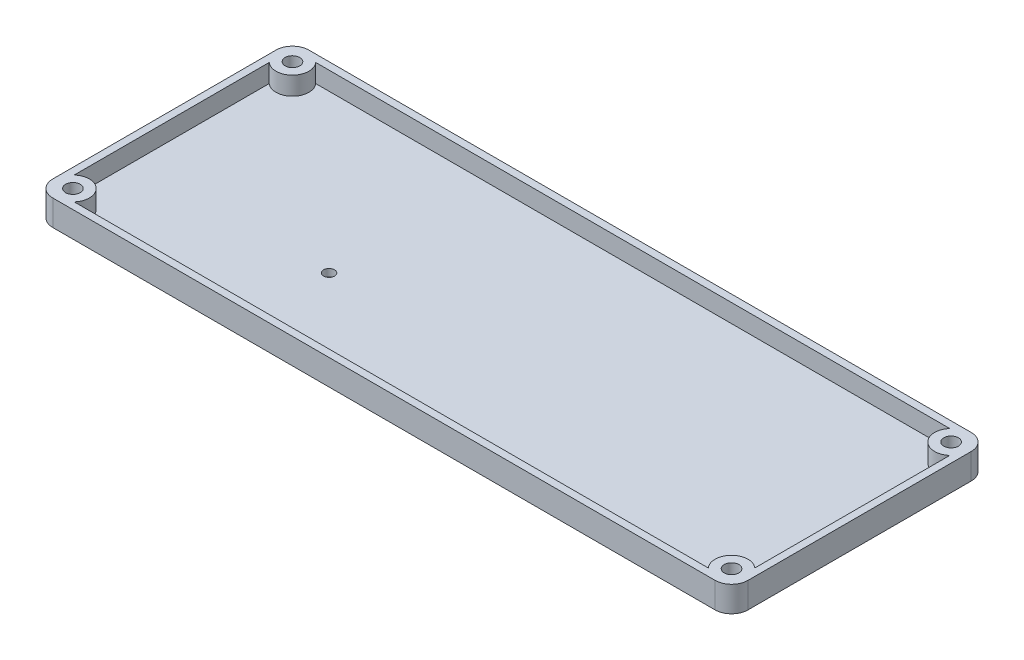
from build123d import *

# Parameters (mm, degrees)
SKETCH1_W           = 190
SKETCH1_H           = 70
BOSS_EXTRUDE1_DEPTH = 2
SKETCH2_W           = 190
SKETCH2_H           = 70
SKETCH2_W_2         = 186
SKETCH2_H_2         = 66
BOSS_EXTRUDE2_DEPTH = 5
SKETCH3_R           = 4.5
BOSS_EXTRUDE3_DEPTH = 5
SKETCH4_R           = 2
CUT_EXTRUDE1_DEPTH  = 14
SKETCH5_R           = 3.3
CUT_EXTRUDE2_DEPTH  = 2.5
FILLET1_R           = 4.5
SKETCH6_R           = 1.5
CUT_EXTRUDE3_DEPTH  = 2.5
CUT_EXTRUDE4_DEPTH  = 1


with BuildPart() as part:
    # Sketch1 → Boss-Extrude1 (new body)
    with BuildSketch(Plane(origin=(0, 0, 0), x_dir=(1, 0, 0), z_dir=(0, 1, 0))):
        with Locations((95, 35)):
            Rectangle(SKETCH1_W, SKETCH1_H)
    extrude(amount=BOSS_EXTRUDE1_DEPTH)

    # Sketch2 → Boss-Extrude2 (add)
    with BuildSketch(Plane(origin=(0, 2, 0), x_dir=(1, 0, 0), z_dir=(0, 1, 0))):
        with Locations((95, 35)):
            Rectangle(SKETCH2_W, SKETCH2_H)
        with Locations((95, 35)):
            Rectangle(SKETCH2_W_2, SKETCH2_H_2, mode=Mode.SUBTRACT)
    extrude(amount=BOSS_EXTRUDE2_DEPTH)

    # Sketch3 → Boss-Extrude3 (add)
    with BuildSketch(Plane(origin=(0, 2, 0), x_dir=(1, 0, 0), z_dir=(0, 1, 0))):
        with Locations((5, 65)):
            Circle(SKETCH3_R)
        with Locations((5, 5)):
            Circle(SKETCH3_R)
        with Locations((185, 65)):
            Circle(SKETCH3_R)
        with Locations((185, 5)):
            Circle(SKETCH3_R)
    extrude(amount=BOSS_EXTRUDE3_DEPTH)

    # Sketch4 → Cut-Extrude1 (cut)
    with BuildSketch(Plane(origin=(0, 7, 0), x_dir=(1, 0, 0), z_dir=(0, 1, 0))):
        with Locations(Location((5, 65, 0), (0, 0, 270))):
            Circle(SKETCH4_R)
        with Locations(Location((185, 65, 0), (0, 0, 270))):
            Circle(SKETCH4_R)
        with Locations(Location((185, 5, 0), (0, 0, 270))):
            Circle(SKETCH4_R)
        with Locations(Location((5, 5, 0), (0, 0, 270))):
            Circle(SKETCH4_R)
    extrude(amount=-CUT_EXTRUDE1_DEPTH, mode=Mode.SUBTRACT)

    # Sketch5 → Cut-Extrude2 (cut)
    with BuildSketch(Plane.XZ):
        with Locations(Location((5, -5, 0), (0, 0, 270))):
            Circle(SKETCH5_R)
        with Locations(Location((5, -65, 0), (0, 0, 270))):
            Circle(SKETCH5_R)
        with Locations(Location((185, -5, 0), (0, 0, 270))):
            Circle(SKETCH5_R)
        with Locations(Location((185, -65, 0), (0, 0, 270))):
            Circle(SKETCH5_R)
    extrude(amount=-CUT_EXTRUDE2_DEPTH, mode=Mode.SUBTRACT)

    # Fillet1
    fillet1_edges = [part.edges().sort_by_distance(p)[0] for p in [
        (0, 3.5, -70),
        (190, 3.5, -70),
        (190, 3.5, 0),
        (0, 3.5, 0),
    ]]
    fillet(fillet1_edges, radius=FILLET1_R)

    # Sketch6 → Cut-Extrude3 (cut)
    with BuildSketch(Plane.XZ):
        with Locations(Location((55, -25, 0), (0, 0, 270))):
            Circle(SKETCH6_R)
    extrude(amount=-CUT_EXTRUDE3_DEPTH, mode=Mode.SUBTRACT)

    # Sketch7 → Cut-Extrude4 (cut)
    # profile 1 of 18: a face of its own
    with BuildSketch(Plane.XZ):
        Polygon((55, -33), (53, -35), (54, -35), (54, -45), (56, -45), (56, -35), (57, -35), align=None)
    # profile 2 of 18: a face of its own
    with BuildSketch(Plane.XZ):
        with BuildLine():
            add(Edge.make_bspline(
                [(59.863147605, -7.967546432), (59.853196578, -7.966763633), (59.833828735, -7.965240058), (59.810363419, -7.944537402), (59.798279232, -7.912782237), (59.797317429, -7.8887466), (59.796774194, -7.875171065)],
                knots=[0, 0, 0, 0, 0.908649445, 1.768519074, 2.739640457, 4, 4, 4, 4], degree=3))
            Line((59.796774194, -7.875171065), (59.796774194, -7.557673509))
            add(Edge.make_bspline(
                [(59.796774194, -7.557673509), (59.797291078, -7.543866404), (59.798199656, -7.519596306), (59.810362789, -7.487622702), (59.833828894, -7.466920307), (59.853196632, -7.465396698), (59.863147605, -7.464613881)],
                knots=[0, 0, 0, 0, 1.274765926, 2.240780674, 3.096128683, 4, 4, 4, 4], degree=3))
            Line((59.863147605, -7.464613881), (63.230400782, -7.464613881))
            add(Edge.make_bspline(
                [(63.230400782, -7.464613881), (63.240351755, -7.465396698), (63.259719493, -7.466920307), (63.283185598, -7.487622702), (63.295348731, -7.519596306), (63.296257309, -7.543866404), (63.296774194, -7.557673509)],
                knots=[0, 0, 0, 0, 0.903871317, 1.759219326, 2.725234074, 4, 4, 4, 4], degree=3))
            Line((63.296774194, -7.557673509), (63.296774194, -7.875171065))
            add(Edge.make_bspline(
                [(63.296774194, -7.875171065), (63.296230958, -7.8887466), (63.295269155, -7.912782237), (63.283184968, -7.944537402), (63.259719653, -7.965240058), (63.240351809, -7.966763633), (63.230400782, -7.967546432)],
                knots=[0, 0, 0, 0, 1.260359543, 2.231480926, 3.091350555, 4, 4, 4, 4], degree=3))
            Line((63.230400782, -7.967546432), (59.863147605, -7.967546432))
        make_face()
    # profile 3 of 18: a face of its own
    with BuildSketch(Plane.XZ):
        with BuildLine():
            add(Edge.make_bspline(
                [(59.863147605, -11.928739003), (59.853196578, -11.927956204), (59.833828735, -11.926432629), (59.810363419, -11.905729973), (59.798279232, -11.873974808), (59.797317429, -11.849939171), (59.796774194, -11.836363636)],
                knots=[0, 0, 0, 0, 0.908649445, 1.768519074, 2.739640457, 4, 4, 4, 4], degree=3))
            Line((59.796774194, -11.836363636), (59.796774194, -11.571554252))
            add(Edge.make_bspline(
                [(59.796774194, -11.571554252), (59.797317429, -11.557978718), (59.798279232, -11.53394308), (59.810363419, -11.502187916), (59.833828735, -11.481485259), (59.853196578, -11.479961685), (59.863147605, -11.479178886)],
                knots=[0, 0, 0, 0, 1.260359543, 2.231480926, 3.091350555, 4, 4, 4, 4], degree=3))
            Line((59.863147605, -11.479178886), (61.352785924, -11.479178886))
            add(Edge.make_bspline(
                [(61.352785924, -11.479178886), (61.387708823, -11.478564959), (61.455206768, -11.47737838), (61.552491088, -11.467120334), (61.642034799, -11.450136846), (61.723702502, -11.426745228), (61.797058009, -11.395259827), (61.863549393, -11.358836152), (61.921552968, -11.313884913), (61.971271024, -11.261822379), (62.01370312, -11.203637908), (62.050848085, -11.140366705), (62.082278351, -11.07153432), (62.108509278, -10.997203293), (62.128117226, -10.917175348), (62.141330279, -10.831518545), (62.150788197, -10.740613593), (62.151591437, -10.67793432), (62.15200391, -10.645747801)],
                knots=[0, 0, 0, 0, 1.259768966, 2.434844153, 3.52426757, 4.54504382, 5.492710978, 6.399140191, 7.273200687, 8.128780347, 8.987953982, 9.865841398, 10.771672702, 11.713857102, 12.705831583, 13.739464049, 14.839189059, 16, 16, 16, 16], degree=3))
            add(Edge.make_bspline(
                [(62.15200391, -10.645747801), (62.151304502, -10.602396702), (62.149948061, -10.518321143), (62.140713987, -10.395969679), (62.123500359, -10.281728426), (62.100390198, -10.175377802), (62.071357982, -10.076625356), (62.034203801, -9.986315859), (61.991269208, -9.903455664), (61.941110279, -9.829123261), (61.884695777, -9.76345244), (61.823961468, -9.705115107), (61.756566036, -9.657006344), (61.684399661, -9.616901775), (61.6064106, -9.585927374), (61.523153376, -9.564522059), (61.434947653, -9.549984672), (61.374287435, -9.548799073), (61.343206256, -9.548191593)],
                knots=[0, 0, 0, 0, 1.348773945, 2.61582582, 3.81412238, 4.940208814, 5.999872851, 7.011943229, 7.973728224, 8.898789004, 9.794729977, 10.663185647, 11.512053099, 12.363290204, 13.226423851, 14.114602726, 15.033957161, 16, 16, 16, 16], degree=3))
            Line((61.343206256, -9.548191593), (59.863147605, -9.548191593))
            add(Edge.make_bspline(
                [(59.863147605, -9.548191593), (59.853196578, -9.547408794), (59.833828735, -9.54588522), (59.810363419, -9.525182563), (59.798279232, -9.493427399), (59.797317429, -9.469391761), (59.796774194, -9.455816227)],
                knots=[0, 0, 0, 0, 0.908649445, 1.768519074, 2.739640457, 4, 4, 4, 4], degree=3))
            Line((59.796774194, -9.455816227), (59.796774194, -9.191006843))
            add(Edge.make_bspline(
                [(59.796774194, -9.191006843), (59.797317429, -9.177431308), (59.798279232, -9.153395671), (59.810363419, -9.121640506), (59.833828735, -9.10093785), (59.853196578, -9.099414275), (59.863147605, -9.098631476)],
                knots=[0, 0, 0, 0, 1.260359543, 2.231480926, 3.091350555, 4, 4, 4, 4], degree=3))
            Line((59.863147605, -9.098631476), (61.754447703, -9.098631476))
            add(Edge.make_bspline(
                [(61.754447703, -9.098631476), (61.78660792, -9.098676617), (61.8470518, -9.098761457), (61.931906642, -9.098209015), (62.005344019, -9.096586134), (62.087738768, -9.09522259), (62.181165647, -9.090088927), (62.253528401, -9.082495186), (62.288856305, -9.078787879)],
                knots=[0, 0, 0, 0, 1.08181779, 2.033234585, 2.854331909, 3.552694975, 4.805211929, 6, 6, 6, 6], degree=3))
            add(Edge.make_bspline(
                [(62.288856305, -9.078787879), (62.294089892, -9.077968145), (62.303996849, -9.076416424), (62.318632288, -9.079851343), (62.33035338, -9.089181666), (62.342702442, -9.106856306), (62.353078373, -9.134836355), (62.354494545, -9.158749383), (62.355229717, -9.171163245)],
                knots=[0, 0, 0, 0, 0.72159608, 1.365950817, 1.991066733, 2.728730001, 4.301800388, 6, 6, 6, 6], degree=3))
            Line((62.355229717, -9.171163245), (62.355229717, -9.409286413))
            add(Edge.make_bspline(
                [(62.355229717, -9.409286413), (62.354686481, -9.422861947), (62.353724678, -9.446897584), (62.341640491, -9.478652749), (62.318175176, -9.499355405), (62.298807332, -9.50087898), (62.288856305, -9.501661779)],
                knots=[0, 0, 0, 0, 1.260359543, 2.231480926, 3.091350555, 4, 4, 4, 4], degree=3))
            Line((62.288856305, -9.501661779), (62.028836755, -9.501661779))
            add(Edge.make_bspline(
                [(62.028836755, -9.501661779), (62.061502696, -9.533186504), (62.126455127, -9.595869759), (62.20665955, -9.705107801), (62.275440535, -9.821936757), (62.320272711, -9.927714254), (62.350333198, -10.018027484), (62.369295936, -10.092642213), (62.385698071, -10.172993429), (62.398484303, -10.259830005), (62.40862404, -10.352506402), (62.416040737, -10.451551766), (62.42105082, -10.556513941), (62.421416002, -10.62863511), (62.421603128, -10.665591398)],
                knots=[0, 0, 0, 0, 1.285994173, 2.557050035, 3.830213077, 5.126135098, 5.807640215, 6.529699271, 7.309003317, 8.133665016, 9.019162744, 9.953812399, 10.951493715, 12, 12, 12, 12], degree=3))
            add(Edge.make_bspline(
                [(62.421603128, -10.665591398), (62.420885579, -10.716257447), (62.419490245, -10.814781714), (62.406722058, -10.957551481), (62.387852138, -11.090875862), (62.358504684, -11.213982202), (62.323012303, -11.328230823), (62.277635817, -11.432374841), (62.224908736, -11.527166428), (62.163677984, -11.611807901), (62.095150683, -11.68656331), (62.019786075, -11.751840929), (61.937421543, -11.806663375), (61.848187771, -11.851420982), (61.752724491, -11.886491944), (61.650287375, -11.910865226), (61.541431833, -11.926337521), (61.466427598, -11.927926213), (61.428054741, -11.928739003)],
                knots=[0, 0, 0, 0, 1.330632541, 2.587523548, 3.762819412, 4.864452765, 5.908531496, 6.901411748, 7.843035704, 8.752701931, 9.639000788, 10.501403352, 11.365531742, 12.231030019, 13.118158849, 14.030780144, 14.992529003, 16, 16, 16, 16], degree=3))
            Line((61.428054741, -11.928739003), (59.863147605, -11.928739003))
        make_face()
    # profile 4 of 18: a face of its own
    with BuildSketch(Plane.XZ):
        with BuildLine():
            add(Edge.make_bspline(
                [(60.108797654, -12.948973607), (60.090390968, -13.016468276), (60.053564381, -13.151506072), (60.017596628, -13.358739252), (59.994794913, -13.569083091), (59.991885606, -13.710497194), (59.990420332, -13.78172043)],
                knots=[0, 0, 0, 0, 0.994369919, 1.989453738, 2.987388049, 4, 4, 4, 4], degree=3))
            add(Edge.make_bspline(
                [(59.990420332, -13.78172043), (59.990881495, -13.810920826), (59.991783027, -13.868004965), (59.996858982, -13.951677177), (60.007412956, -14.031101547), (60.021156312, -14.106669041), (60.037685854, -14.178721186), (60.059967927, -14.246402886), (60.085234271, -14.310540782), (60.114142203, -14.370253902), (60.146907461, -14.424321007), (60.182305922, -14.471887706), (60.220782695, -14.512093095), (60.262328256, -14.544705269), (60.306387964, -14.570150043), (60.352964795, -14.589211371), (60.402728506, -14.600395548), (60.436959536, -14.60155931), (60.454349951, -14.602150538)],
                knots=[0, 0, 0, 0, 1.346994569, 2.633252809, 3.863792275, 5.040020595, 6.175553146, 7.270140882, 8.323137895, 9.35355687, 10.326063697, 11.235037844, 12.083228149, 12.885067403, 13.662802519, 14.422758895, 15.198713071, 16, 16, 16, 16], degree=3))
            add(Edge.make_bspline(
                [(60.454349951, -14.602150538), (60.474866639, -14.600443127), (60.517019331, -14.596935156), (60.578698875, -14.571035267), (60.638072364, -14.529195149), (60.695372731, -14.472828528), (60.749420482, -14.405085552), (60.800129556, -14.329511703), (60.846430769, -14.24734413), (60.871816605, -14.188652346), (60.884750733, -14.158748778)],
                knots=[0, 0, 0, 0, 0.757553549, 1.556436519, 2.436199565, 3.432482492, 4.518043986, 5.63637707, 6.795729922, 8, 8, 8, 8], degree=3))
            add(Edge.make_bspline(
                [(60.884750733, -14.158748778), (60.911425922, -14.089800504), (60.965147931, -13.950943387), (61.037658578, -13.739545126), (61.111174978, -13.530063542), (61.165313825, -13.393350963), (61.19198436, -13.326001955)],
                knots=[0, 0, 0, 0, 0.999272046, 2.012465694, 3.020876762, 4, 4, 4, 4], degree=3))
            add(Edge.make_bspline(
                [(61.19198436, -13.326001955), (61.207720121, -13.288370834), (61.237674856, -13.2167359), (61.294823554, -13.121179504), (61.354921943, -13.039394481), (61.423008637, -12.975354117), (61.49377188, -12.92564901), (61.56638161, -12.88910328), (61.641138568, -12.866710646), (61.691809454, -12.864063063), (61.716813294, -12.862756598)],
                knots=[0, 0, 0, 0, 1.314744679, 2.502759547, 3.584908587, 4.579459045, 5.504566142, 6.367105949, 7.194239026, 8, 8, 8, 8], degree=3))
            add(Edge.make_bspline(
                [(61.716813294, -12.862756598), (61.745212001, -12.863606027), (61.800779899, -12.865268109), (61.881074307, -12.884312639), (61.956732337, -12.912351467), (62.025435304, -12.95481381), (62.088928542, -13.005513493), (62.147781329, -13.064422736), (62.201264579, -13.131528952), (62.248144944, -13.207586512), (62.290561451, -13.290059622), (62.326882849, -13.37960607), (62.356949746, -13.475745082), (62.3804405, -13.578111784), (62.398527379, -13.685328691), (62.412581016, -13.796001792), (62.419853966, -13.910262751), (62.421013583, -13.987446384), (62.421603128, -14.026686217)],
                knots=[0, 0, 0, 0, 0.900092938, 1.761216595, 2.607372669, 3.452132317, 4.313042678, 5.183800992, 6.091093859, 7.031694717, 8.016552302, 9.033493873, 10.096525602, 11.2122754, 12.366239778, 13.548637049, 14.753737401, 16, 16, 16, 16], degree=3))
            add(Edge.make_bspline(
                [(62.421603128, -14.026686217), (62.421285236, -14.067059253), (62.420669091, -14.145311019), (62.417523052, -14.258493859), (62.411234584, -14.363663953), (62.40040465, -14.492744394), (62.381147609, -14.649078371), (62.357529471, -14.771736598), (62.345650049, -14.833431085)],
                knots=[0, 0, 0, 0, 0.895214355, 1.735121068, 2.510238594, 3.230947064, 4.607225083, 6, 6, 6, 6], degree=3))
            add(Edge.make_bspline(
                [(62.345650049, -14.833431085), (62.34206169, -14.845888992), (62.335071771, -14.870156284), (62.320632751, -14.901980395), (62.296879738, -14.928049094), (62.275901751, -14.926545463), (62.265591398, -14.925806452)],
                knots=[0, 0, 0, 0, 1.143800591, 2.228058362, 3.129118321, 4, 4, 4, 4], degree=3))
            Line((62.265591398, -14.925806452), (62.123264907, -14.905962854))
            add(Edge.make_bspline(
                [(62.123264907, -14.905962854), (62.112080598, -14.902923851), (62.090605479, -14.897088625), (62.073365043, -14.866325641), (62.070526152, -14.833560117), (62.07422178, -14.811503058), (62.076050831, -14.80058651)],
                knots=[0, 0, 0, 0, 1.020133385, 1.958769859, 2.989748114, 4, 4, 4, 4], degree=3))
            add(Edge.make_bspline(
                [(62.076050831, -14.80058651), (62.089055884, -14.745567962), (62.114837673, -14.636496765), (62.133701988, -14.496463023), (62.143970715, -14.380570167), (62.148085624, -14.285362135), (62.152075054, -14.182046353), (62.152028217, -14.110399199), (62.15200391, -14.073216031)],
                knots=[0, 0, 0, 0, 1.386762124, 2.749178399, 3.462753977, 4.24182689, 5.087550007, 6, 6, 6, 6], degree=3))
            add(Edge.make_bspline(
                [(62.15200391, -14.073216031), (62.151904325, -14.042183366), (62.15171157, -13.982117369), (62.145618515, -13.895198528), (62.138205334, -13.814221661), (62.125409725, -13.739422726), (62.110760792, -13.670302767), (62.092662564, -13.60690261), (62.069592999, -13.550026316), (62.044958288, -13.49841233), (62.015689814, -13.453368613), (61.983416749, -13.41378941), (61.947368696, -13.380192682), (61.907485812, -13.353226312), (61.864976212, -13.331340946), (61.818225284, -13.317720328), (61.768830645, -13.307162703), (61.734438558, -13.306498664), (61.716813294, -13.306158358)],
                knots=[0, 0, 0, 0, 1.503915486, 2.910938577, 4.222394645, 5.443931175, 6.586874855, 7.647022119, 8.634630082, 9.559329068, 10.415015653, 11.23188826, 12.029986639, 12.79364086, 13.560091627, 14.336447829, 15.147462489, 16, 16, 16, 16], degree=3))
            add(Edge.make_bspline(
                [(61.716813294, -13.306158358), (61.701115246, -13.307353653), (61.668798586, -13.309814337), (61.621874917, -13.330767821), (61.576893614, -13.363959896), (61.533151037, -13.410665502), (61.490628641, -13.472389607), (61.448379988, -13.550724252), (61.406365695, -13.646781278), (61.380845807, -13.717682729), (61.367155425, -13.755718475)],
                knots=[0, 0, 0, 0, 0.623915995, 1.284419598, 2.014022972, 2.843947168, 3.823100145, 4.995485374, 6.388200081, 8, 8, 8, 8], degree=3))
            add(Edge.make_bspline(
                [(61.367155425, -13.755718475), (61.342384237, -13.825693789), (61.293326052, -13.964276643), (61.233995325, -14.138303961), (61.187369131, -14.278811672), (61.146802399, -14.386915605), (61.104900566, -14.499877975), (61.074665569, -14.576204385), (61.059237537, -14.615151515)],
                knots=[0, 0, 0, 0, 1.463376688, 2.898149422, 3.624773662, 4.38158818, 5.174171877, 6, 6, 6, 6], degree=3))
            add(Edge.make_bspline(
                [(61.059237537, -14.615151515), (61.045117749, -14.648473046), (61.017297434, -14.714126685), (60.959485694, -14.803910301), (60.892699568, -14.885771487), (60.815467908, -14.957162017), (60.73218192, -15.0169775), (60.642611101, -15.05916239), (60.549999795, -15.087113977), (60.486251002, -15.089969096), (60.454349951, -15.091397849)],
                knots=[0, 0, 0, 0, 1.062594765, 2.093637697, 3.127752945, 4.162498956, 5.178616766, 6.129773465, 7.064104764, 8, 8, 8, 8], degree=3))
            add(Edge.make_bspline(
                [(60.454349951, -15.091397849), (60.423667147, -15.0901262), (60.363906007, -15.087649398), (60.27769091, -15.067038798), (60.197930162, -15.034190466), (60.12539462, -14.98731038), (60.059710977, -14.929274989), (60.000237777, -14.861806706), (59.946363156, -14.785644905), (59.898803482, -14.700875438), (59.857544263, -14.607981971), (59.820209731, -14.508797321), (59.789873141, -14.402483514), (59.764763808, -14.290504685), (59.744957183, -14.174481215), (59.731844764, -14.055869401), (59.722135997, -13.936067056), (59.721260702, -13.855640725), (59.720821114, -13.815249267)],
                knots=[0, 0, 0, 0, 0.903629083, 1.760005473, 2.598019276, 3.435628247, 4.29345561, 5.174712472, 6.081538837, 7.039108918, 8.035333181, 9.075853511, 10.1612372, 11.29182403, 12.458184468, 13.629323546, 14.809406344, 16, 16, 16, 16], degree=3))
            add(Edge.make_bspline(
                [(59.720821114, -13.815249267), (59.72112788, -13.769174513), (59.721708092, -13.682029225), (59.724830488, -13.557439357), (59.73134891, -13.443624616), (59.739208429, -13.336336537), (59.751073157, -13.23176829), (59.762560208, -13.125663061), (59.780245458, -13.015770495), (59.794318993, -12.940957441), (59.801564027, -12.902443793)],
                knots=[0, 0, 0, 0, 1.204724343, 2.278602536, 3.258119262, 4.185257241, 5.090815572, 6.009552876, 6.975320804, 8, 8, 8, 8], degree=3))
            add(Edge.make_bspline(
                [(59.801564027, -12.902443793), (59.805789589, -12.889008747), (59.813378063, -12.86488142), (59.831295294, -12.834486788), (59.857666398, -12.816898605), (59.876841734, -12.816906904), (59.886412512, -12.816911046)],
                knots=[0, 0, 0, 0, 1.276381282, 2.292189255, 3.147598869, 4, 4, 4, 4], degree=3))
            Line((59.886412512, -12.816911046), (60.061583578, -12.842913001))
            add(Edge.make_bspline(
                [(60.061583578, -12.842913001), (60.072758871, -12.845574894), (60.093329793, -12.850474773), (60.114002473, -12.876656648), (60.118549928, -12.911508216), (60.112324164, -12.935425783), (60.108797654, -12.948973607)],
                knots=[0, 0, 0, 0, 0.990911764, 1.824020914, 2.767442244, 4, 4, 4, 4], degree=3))
        make_face()
    # profile 5 of 18: a face of its own
    with BuildSketch(Plane.XZ):
        with BuildLine():
            add(Edge.make_bspline(
                [(60.983968719, -16.154740958), (60.945623691, -16.154932497), (60.870966556, -16.155305421), (60.761939021, -16.167871511), (60.660167145, -16.193659695), (60.565014762, -16.22923415), (60.477045832, -16.275002213), (60.396882551, -16.331507717), (60.323152022, -16.396282126), (60.258081416, -16.471945534), (60.199941525, -16.555464911), (60.149100322, -16.647290576), (60.105537425, -16.746815676), (60.068445679, -16.853541878), (60.039841822, -16.967593779), (60.019655152, -17.087948997), (60.006980119, -17.214619821), (60.005531668, -17.301077086), (60.004789834, -17.345356794)],
                knots=[0, 0, 0, 0, 1.052742135, 2.049671496, 3.00535886, 3.929204305, 4.834274151, 5.720591304, 6.616968932, 7.522753949, 8.454235396, 9.407702715, 10.400608683, 11.434771335, 12.507454939, 13.625917802, 14.784096809, 16, 16, 16, 16], degree=3))
            add(Edge.make_bspline(
                [(60.004789834, -17.345356794), (60.005101854, -17.388704346), (60.005716449, -17.474087291), (60.013039149, -17.600277073), (60.023519387, -17.722453961), (60.039367271, -17.840486067), (60.059687338, -17.954293154), (60.085533415, -18.064067844), (60.117702273, -18.169532686), (60.14333495, -18.237533213), (60.15601173, -18.271163245)],
                knots=[0, 0, 0, 0, 1.102197096, 2.171029949, 3.213425678, 4.219959897, 5.198409492, 6.152274672, 7.086197335, 8, 8, 8, 8], degree=3))
            add(Edge.make_bspline(
                [(60.15601173, -18.271163245), (60.15974393, -18.283477994), (60.166065143, -18.304335439), (60.165695975, -18.334444607), (60.148315098, -18.355019377), (60.132132027, -18.356098304), (60.123167155, -18.356695992)],
                knots=[0, 0, 0, 0, 1.377967994, 2.333859513, 3.077014731, 4, 4, 4, 4], degree=3))
            Line((60.123167155, -18.356695992), (59.910361681, -18.356695992))
            add(Edge.make_bspline(
                [(59.910361681, -18.356695992), (59.903277544, -18.355705016), (59.88865013, -18.353658836), (59.869917438, -18.337760573), (59.855000683, -18.314040531), (59.84792564, -18.294846177), (59.84398827, -18.284164223)],
                knots=[0, 0, 0, 0, 0.805177264, 1.662539859, 2.699167436, 4, 4, 4, 4], degree=3))
            add(Edge.make_bspline(
                [(59.84398827, -18.284164223), (59.824757655, -18.210071505), (59.785715547, -18.059648036), (59.755328481, -17.865540484), (59.737018461, -17.704814629), (59.727516466, -17.578360363), (59.722138878, -17.447131627), (59.721265471, -17.35790661), (59.720821114, -17.312512219)],
                knots=[0, 0, 0, 0, 1.40169322, 2.845725757, 3.594219466, 4.365327473, 5.168339027, 6, 6, 6, 6], degree=3))
            add(Edge.make_bspline(
                [(59.720821114, -17.312512219), (59.721842245, -17.246786552), (59.723823781, -17.119243754), (59.739924446, -16.934163838), (59.764900825, -16.761022978), (59.803093397, -16.600668702), (59.849380333, -16.452018631), (59.90818746, -16.316346678), (59.976141433, -16.192306256), (60.056241633, -16.081216777), (60.146653976, -15.982702901), (60.248558215, -15.897688209), (60.360719375, -15.825578904), (60.483509676, -15.766121338), (60.617531792, -15.721449039), (60.761611332, -15.68848899), (60.916635452, -15.669502992), (61.023376027, -15.666857368), (61.078396872, -15.665493646)],
                knots=[0, 0, 0, 0, 1.292662603, 2.508453861, 3.651879959, 4.730373967, 5.747743145, 6.710384614, 7.634248813, 8.524569618, 9.397722041, 10.257691375, 11.127621715, 12.014578555, 12.933987002, 13.900489362, 14.91777939, 16, 16, 16, 16], degree=3))
            add(Edge.make_bspline(
                [(61.078396872, -15.665493646), (61.127264302, -15.666889825), (61.223101132, -15.669627956), (61.363338414, -15.68870222), (61.495967841, -15.721860613), (61.62176476, -15.766954502), (61.740015464, -15.826100021), (61.850529202, -15.898849652), (61.95535137, -15.98282105), (62.016836002, -16.048781021), (62.04799609, -16.082209189)],
                knots=[0, 0, 0, 0, 1.076538849, 2.111264504, 3.110647609, 4.083489088, 5.04981971, 6.015706, 6.994370218, 8, 8, 8, 8], degree=3))
            add(Edge.make_bspline(
                [(62.04799609, -16.082209189), (62.077951384, -16.119283909), (62.137633391, -16.193150441), (62.21362384, -16.314020008), (62.278028666, -16.441681259), (62.331412006, -16.576649335), (62.370930147, -16.719279228), (62.400927463, -16.868521198), (62.41784186, -17.025189042), (62.420332005, -17.132056385), (62.421603128, -17.186608016)],
                knots=[0, 0, 0, 0, 0.959570818, 1.911819386, 2.869440873, 3.837075269, 4.830549371, 5.847060356, 6.901007889, 8, 8, 8, 8], degree=3))
            add(Edge.make_bspline(
                [(62.421603128, -17.186608016), (62.420445424, -17.246186049), (62.418199942, -17.361743597), (62.400268497, -17.528785688), (62.371344324, -17.683955246), (62.329657602, -17.827030746), (62.275849096, -17.958707831), (62.211366426, -18.080546723), (62.134120246, -18.192042469), (62.073410996, -18.25812749), (62.043206256, -18.291006843)],
                knots=[0, 0, 0, 0, 1.192962932, 2.313870807, 3.360277429, 4.350443429, 5.292885604, 6.20434094, 7.106603774, 8, 8, 8, 8], degree=3))
            add(Edge.make_bspline(
                [(62.043206256, -18.291006843), (62.014594257, -18.318144463), (61.957754458, -18.3720553), (61.862237605, -18.440782771), (61.759506164, -18.498181824), (61.650438414, -18.546527819), (61.533881785, -18.583603822), (61.410249203, -18.609108665), (61.279766984, -18.6252559), (61.190436356, -18.627302016), (61.144770283, -18.628347996)],
                knots=[0, 0, 0, 0, 0.959100818, 1.905322873, 2.855008243, 3.819573611, 4.804630969, 5.826054116, 6.888672642, 8, 8, 8, 8], degree=3))
            add(Edge.make_bspline(
                [(61.144770283, -18.628347996), (61.126512975, -18.628249454), (61.094761047, -18.628078075), (61.053444337, -18.626320336), (61.022126252, -18.62005329), (60.999183484, -18.601910223), (60.989411307, -18.570133245), (60.984758535, -18.526416356), (60.984737063, -18.464764149), (60.984248314, -18.417349156), (60.983968719, -18.390224829)],
                knots=[0, 0, 0, 0, 1.206600317, 2.09844112, 2.738642955, 3.285119951, 3.934843349, 4.862682008, 6.205258866, 8, 8, 8, 8], degree=3))
            Line((60.983968719, -18.390224829), (60.983968719, -16.154740958))
        make_face()
        with BuildLine():
            add(Edge.make_bspline(
                [(61.253567937, -18.139100684), (61.28506813, -18.138418222), (61.346394425, -18.137089568), (61.43568237, -18.127530466), (61.51957348, -18.111321258), (61.598317604, -18.087733013), (61.673192916, -18.057756349), (61.743230372, -18.018898332), (61.811011546, -17.974393148), (61.851991927, -17.938876584), (61.872825024, -17.920821114)],
                knots=[0, 0, 0, 0, 1.123252598, 2.186809492, 3.198198472, 4.165857566, 5.114457143, 6.068100185, 7.017884771, 8, 8, 8, 8], degree=3))
            add(Edge.make_bspline(
                [(61.872825024, -17.920821114), (61.895335979, -17.899958732), (61.940271678, -17.858313861), (61.996609792, -17.785544235), (62.045438013, -17.706908266), (62.083940405, -17.620804591), (62.115160409, -17.528565357), (62.136716339, -17.429429651), (62.149979179, -17.323595696), (62.151316515, -17.250741534), (62.15200391, -17.213294233)],
                knots=[0, 0, 0, 0, 0.936695696, 1.8698042, 2.802443791, 3.760228364, 4.745700779, 5.774108451, 6.85588372, 8, 8, 8, 8], degree=3))
            add(Edge.make_bspline(
                [(62.15200391, -17.213294233), (62.151383033, -17.17447107), (62.150166375, -17.098394038), (62.135727649, -16.987459951), (62.114363057, -16.881670658), (62.082628774, -16.781906623), (62.042902165, -16.687329002), (61.99405422, -16.598435761), (61.935809615, -16.515257805), (61.890679948, -16.464741537), (61.868035191, -16.439393939)],
                knots=[0, 0, 0, 0, 1.101422593, 2.158323925, 3.170423239, 4.1615733, 5.124858472, 6.07827879, 7.035736068, 8, 8, 8, 8], degree=3))
            add(Edge.make_bspline(
                [(61.868035191, -16.439393939), (61.846419802, -16.420127535), (61.802763721, -16.381215638), (61.731907192, -16.328841364), (61.655578974, -16.282150863), (61.576349551, -16.240020129), (61.494727954, -16.205625018), (61.413876812, -16.1779352), (61.333303612, -16.161530602), (61.279857599, -16.156979573), (61.253567937, -16.154740958)],
                knots=[0, 0, 0, 0, 1.006534989, 2.032874594, 3.058570428, 4.115796305, 5.149951567, 6.135646373, 7.08293953, 8, 8, 8, 8], degree=3))
            Line((61.253567937, -16.154740958), (61.253567937, -18.139100684))
        make_face(mode=Mode.SUBTRACT)
    # profile 6 of 18: a face of its own
    with BuildSketch(Plane.XZ):
        with BuildLine():
            add(Edge.make_bspline(
                [(62.067155425, -21.200488759), (62.071567489, -21.179100469), (62.081039986, -21.133180807), (62.089412516, -21.058580881), (62.093809113, -20.97428168), (62.094726886, -20.914929253), (62.095210166, -20.883675464)],
                knots=[0, 0, 0, 0, 0.822034542, 1.764869883, 2.823025653, 4, 4, 4, 4], degree=3))
            add(Edge.make_bspline(
                [(62.095210166, -20.883675464), (62.094236342, -20.844152873), (62.092341644, -20.767256689), (62.075468005, -20.656043401), (62.049095064, -20.552355015), (62.011444919, -20.456542727), (61.962327649, -20.368677559), (61.902399257, -20.28872883), (61.83136816, -20.216726545), (61.777130535, -20.176165747), (61.749657869, -20.155620723)],
                knots=[0, 0, 0, 0, 1.127743405, 2.19416696, 3.203410281, 4.176830224, 5.124289978, 6.068499432, 7.021648347, 8, 8, 8, 8], degree=3))
            add(Edge.make_bspline(
                [(61.749657869, -20.155620723), (61.726644096, -20.140819803), (61.680193719, -20.110946027), (61.60506071, -20.073620161), (61.525759742, -20.041373826), (61.441555569, -20.015145089), (61.352648281, -19.995732572), (61.258957809, -19.981362246), (61.160690958, -19.972199127), (61.09347115, -19.971318483), (61.059237537, -19.97086999)],
                knots=[0, 0, 0, 0, 0.904499813, 1.825617936, 2.769896146, 3.733949931, 4.738852177, 5.777074489, 6.867911474, 8, 8, 8, 8], degree=3))
            Line((61.059237537, -19.97086999), (59.863147605, -19.97086999))
            add(Edge.make_bspline(
                [(59.863147605, -19.97086999), (59.853196578, -19.970087191), (59.833828735, -19.968563616), (59.810363419, -19.94786096), (59.798279232, -19.916105796), (59.797317429, -19.892070158), (59.796774194, -19.878494624)],
                knots=[0, 0, 0, 0, 0.908649445, 1.768519074, 2.739640457, 4, 4, 4, 4], degree=3))
            Line((59.796774194, -19.878494624), (59.796774194, -19.620527859))
            add(Edge.make_bspline(
                [(59.796774194, -19.620527859), (59.797291078, -19.606720754), (59.798199656, -19.582450656), (59.810362789, -19.550477052), (59.833828894, -19.529774657), (59.853196632, -19.528251048), (59.863147605, -19.527468231)],
                knots=[0, 0, 0, 0, 1.274765926, 2.240780674, 3.096128683, 4, 4, 4, 4], degree=3))
            Line((59.863147605, -19.527468231), (61.783186706, -19.527468231))
            add(Edge.make_bspline(
                [(61.783186706, -19.527468231), (61.810329522, -19.527544423), (61.861879131, -19.527689128), (61.935092042, -19.526723613), (62.000105732, -19.526351317), (62.077663678, -19.524323993), (62.173030495, -19.520875374), (62.249403313, -19.51665001), (62.288856305, -19.514467253)],
                knots=[0, 0, 0, 0, 0.965675187, 1.834009283, 2.604969158, 3.278702825, 4.594220815, 6, 6, 6, 6], degree=3))
            add(Edge.make_bspline(
                [(62.288856305, -19.514467253), (62.298807332, -19.515250052), (62.318175176, -19.516773627), (62.341640491, -19.537476283), (62.353724678, -19.569231448), (62.354686481, -19.593267086), (62.355229717, -19.60684262)],
                knots=[0, 0, 0, 0, 0.908649445, 1.768519074, 2.739640457, 4, 4, 4, 4], degree=3))
            Line((62.355229717, -19.60684262), (62.355229717, -19.851808407))
            add(Edge.make_bspline(
                [(62.355229717, -19.851808407), (62.354686481, -19.865383941), (62.353724678, -19.889419579), (62.341640491, -19.921174743), (62.318175176, -19.941877399), (62.298807332, -19.943400974), (62.288856305, -19.944183773)],
                knots=[0, 0, 0, 0, 1.260359543, 2.231480926, 3.091350555, 4, 4, 4, 4], degree=3))
            Line((62.288856305, -19.944183773), (61.825610948, -19.944183773))
            add(Edge.make_bspline(
                [(61.825610948, -19.944183773), (61.849692159, -19.957874021), (61.897151069, -19.984854567), (61.965022981, -20.028574649), (62.028149103, -20.075140887), (62.086334521, -20.12441813), (62.139767308, -20.176079823), (62.189556315, -20.229059056), (62.233052274, -20.285777467), (62.273325748, -20.343831472), (62.307809238, -20.40507631), (62.339316143, -20.467924857), (62.364015512, -20.534029475), (62.385811524, -20.601633851), (62.401193784, -20.672067039), (62.412741073, -20.744710419), (62.420817463, -20.819859248), (62.421339302, -20.870881218), (62.421603128, -20.896676442)],
                knots=[0, 0, 0, 0, 1.120801408, 2.208859496, 3.264772641, 4.292930845, 5.291668573, 6.271417896, 7.231492946, 8.181264213, 9.128025959, 10.073301881, 11.022893743, 11.980392121, 12.94546748, 13.936326848, 14.956666878, 16, 16, 16, 16], degree=3))
            add(Edge.make_bspline(
                [(62.421603128, -20.896676442), (62.420554165, -20.947428077), (62.41844647, -21.049403942), (62.401417879, -21.149971797), (62.392864125, -21.200488759)],
                knots=[0, 0, 0, 0, 0.995365627, 2, 2, 2, 2], degree=3))
            add(Edge.make_bspline(
                [(62.392864125, -21.200488759), (62.389164172, -21.212969097), (62.381884409, -21.237524517), (62.364656638, -21.270075377), (62.337966142, -21.295788334), (62.314906806, -21.298389229), (62.303225806, -21.299706745)],
                knots=[0, 0, 0, 0, 1.078398995, 2.121780598, 3.048564152, 4, 4, 4, 4], degree=3))
            Line((62.303225806, -21.299706745), (62.104789834, -21.299706745))
            add(Edge.make_bspline(
                [(62.104789834, -21.299706745), (62.096033312, -21.298047448), (62.077413318, -21.294519096), (62.064287939, -21.265213149), (62.060661483, -21.233780161), (62.064974269, -21.211670527), (62.067155425, -21.200488759)],
                knots=[0, 0, 0, 0, 0.838297256, 1.782567338, 2.878551427, 4, 4, 4, 4], degree=3))
        make_face()
    # profile 7 of 18: a face of its own
    with BuildSketch(Plane.XZ):
        with BuildLine():
            add(Edge.make_bspline(
                [(59.79198436, -23.596089932), (59.781181003, -23.550128226), (59.75969299, -23.45870982), (59.737280863, -23.320921048), (59.72393598, -23.183744357), (59.721858046, -23.09272989), (59.720821114, -23.047311828)],
                knots=[0, 0, 0, 0, 1.021154685, 2.031089394, 3.017473748, 4, 4, 4, 4], degree=3))
            add(Edge.make_bspline(
                [(59.720821114, -23.047311828), (59.721614431, -23.004634294), (59.723136389, -22.922758571), (59.734446859, -22.805537098), (59.754158601, -22.699498082), (59.781157429, -22.604655896), (59.815691282, -22.520716623), (59.859313631, -22.448583247), (59.910435287, -22.386856821), (59.951690341, -22.355285473), (59.971945259, -22.339784946)],
                knots=[0, 0, 0, 0, 1.313677166, 2.520254976, 3.620555362, 4.629391279, 5.55136264, 6.405119634, 7.216964544, 8, 8, 8, 8], degree=3))
            add(Edge.make_bspline(
                [(59.971945259, -22.339784946), (59.987278704, -22.330779622), (60.019722659, -22.311725304), (60.074849738, -22.288742176), (60.138040815, -22.270053913), (60.209145619, -22.254251875), (60.288268531, -22.242376866), (60.375701906, -22.233295741), (60.471187249, -22.229051859), (60.537599235, -22.228073432), (60.572043011, -22.227565982)],
                knots=[0, 0, 0, 0, 0.690286974, 1.460574502, 2.312753452, 3.247966373, 4.288201466, 5.419491727, 6.66165052, 8, 8, 8, 8], degree=3))
            Line((60.572043011, -22.227565982), (62.080840665, -22.227565982))
            Line((62.080840665, -22.227565982), (62.080840665, -21.605571848))
            add(Edge.make_bspline(
                [(62.080840665, -21.605571848), (62.0813839, -21.591996313), (62.082345704, -21.567960676), (62.09442989, -21.536205511), (62.117895206, -21.515502855), (62.13726305, -21.51397928), (62.147214076, -21.513196481)],
                knots=[0, 0, 0, 0, 1.260359543, 2.231480926, 3.091350555, 4, 4, 4, 4], degree=3))
            Line((62.147214076, -21.513196481), (62.288856305, -21.513196481))
            add(Edge.make_bspline(
                [(62.288856305, -21.513196481), (62.298807332, -21.51397928), (62.318175176, -21.515502855), (62.341640491, -21.536205511), (62.353724678, -21.567960676), (62.354686481, -21.591996313), (62.355229717, -21.605571848)],
                knots=[0, 0, 0, 0, 0.908649445, 1.768519074, 2.739640457, 4, 4, 4, 4], degree=3))
            Line((62.355229717, -21.605571848), (62.355229717, -22.227565982))
            Line((62.355229717, -22.227565982), (62.993646139, -22.227565982))
            add(Edge.make_bspline(
                [(62.993646139, -22.227565982), (63.004454086, -22.228345526), (63.024384256, -22.229783028), (63.049596492, -22.248041837), (63.063710456, -22.277596473), (63.064415813, -22.300383909), (63.064809384, -22.313098729)],
                knots=[0, 0, 0, 0, 1.008138932, 1.859037646, 2.80539644, 4, 4, 4, 4], degree=3))
            Line((63.064809384, -22.313098729), (63.064809384, -22.590909091))
            add(Edge.make_bspline(
                [(63.064809384, -22.590909091), (63.064433122, -22.603646887), (63.063758786, -22.626475499), (63.049394, -22.655903469), (63.02464245, -22.675055449), (63.004496507, -22.676401261), (62.993646139, -22.6771261)],
                knots=[0, 0, 0, 0, 1.190799007, 2.134143855, 2.995071771, 4, 4, 4, 4], degree=3))
            Line((62.993646139, -22.6771261), (62.355229717, -22.6771261))
            Line((62.355229717, -22.6771261), (62.355229717, -23.410654936))
            add(Edge.make_bspline(
                [(62.355229717, -23.410654936), (62.354615477, -23.424180878), (62.353518422, -23.448338727), (62.342076518, -23.480673837), (62.317835814, -23.500472583), (62.298756528, -23.502607012), (62.288856305, -23.503714565)],
                knots=[0, 0, 0, 0, 1.257127356, 2.24527754, 3.089476251, 4, 4, 4, 4], degree=3))
            Line((62.288856305, -23.503714565), (62.147214076, -23.503714565))
            add(Edge.make_bspline(
                [(62.147214076, -23.503714565), (62.137313853, -23.502607012), (62.118234567, -23.500472583), (62.093993863, -23.480673837), (62.082551959, -23.448338727), (62.081454904, -23.424180878), (62.080840665, -23.410654936)],
                knots=[0, 0, 0, 0, 0.910523749, 1.75472246, 2.742872644, 4, 4, 4, 4], degree=3))
            Line((62.080840665, -23.410654936), (62.080840665, -22.6771261))
            Line((62.080840665, -22.6771261), (60.411241447, -22.6771261))
            add(Edge.make_bspline(
                [(60.411241447, -22.6771261), (60.378271082, -22.678468208), (60.315843486, -22.681009418), (60.228096708, -22.702691114), (60.153612052, -22.740774095), (60.092647286, -22.794796437), (60.045415859, -22.863576444), (60.012531035, -22.947491742), (59.994156279, -23.045834498), (59.991714716, -23.116114037), (59.990420332, -23.153372434)],
                knots=[0, 0, 0, 0, 1.086599273, 2.057416705, 2.955917528, 3.819431463, 4.716892118, 5.682330047, 6.77129718, 8, 8, 8, 8], degree=3))
            add(Edge.make_bspline(
                [(59.990420332, -23.153372434), (59.991069216, -23.185107058), (59.992412575, -23.250805979), (60.004285417, -23.351981409), (60.02190699, -23.459129229), (60.038595863, -23.53185024), (60.047214076, -23.569403715)],
                knots=[0, 0, 0, 0, 0.904670796, 1.872903744, 2.901557435, 4, 4, 4, 4], degree=3))
            add(Edge.make_bspline(
                [(60.047214076, -23.569403715), (60.049467343, -23.580342542), (60.053836076, -23.60155122), (60.049563661, -23.631539832), (60.035485207, -23.65792639), (60.018014977, -23.66098603), (60.009579668, -23.662463343)],
                knots=[0, 0, 0, 0, 1.154537933, 2.238468888, 3.149464017, 4, 4, 4, 4], degree=3))
            Line((60.009579668, -23.662463343), (59.886412512, -23.675464321))
            add(Edge.make_bspline(
                [(59.886412512, -23.675464321), (59.875964124, -23.676574641), (59.855545229, -23.678744498), (59.827031696, -23.662308862), (59.804989967, -23.634002783), (59.796660475, -23.609721348), (59.79198436, -23.596089932)],
                knots=[0, 0, 0, 0, 0.901117206, 1.761019737, 2.74305325, 4, 4, 4, 4], degree=3))
        make_face()
    # profile 8 of 18: a face of its own
    with BuildSketch(Plane.XZ):
        with BuildLine():
            Line((63.003225806, -27.638709677), (59.863147605, -27.638709677))
            add(Edge.make_bspline(
                [(59.863147605, -27.638709677), (59.853196578, -27.637926878), (59.833828735, -27.636403304), (59.810363419, -27.615700648), (59.798279232, -27.583945483), (59.797317429, -27.559909845), (59.796774194, -27.546334311)],
                knots=[0, 0, 0, 0, 0.908649445, 1.768519074, 2.739640457, 4, 4, 4, 4], degree=3))
            Line((59.796774194, -27.546334311), (59.796774194, -27.242521994))
            add(Edge.make_bspline(
                [(59.796774194, -27.242521994), (59.797291078, -27.228714889), (59.798199656, -27.204444791), (59.810362789, -27.172471187), (59.833828894, -27.151768792), (59.853196632, -27.150245183), (59.863147605, -27.149462366)],
                knots=[0, 0, 0, 0, 1.274765926, 2.240780674, 3.096128683, 4, 4, 4, 4], degree=3))
            Line((59.863147605, -27.149462366), (63.003225806, -27.149462366))
            Line((63.003225806, -27.149462366), (63.003225806, -25.787781036))
            add(Edge.make_bspline(
                [(63.003225806, -25.787781036), (63.003742691, -25.773973931), (63.004651269, -25.749703833), (63.016814402, -25.717730229), (63.040280507, -25.697027834), (63.059648245, -25.695504225), (63.069599218, -25.694721408)],
                knots=[0, 0, 0, 0, 1.274765926, 2.240780674, 3.096128683, 4, 4, 4, 4], degree=3))
            Line((63.069599218, -25.694721408), (63.230400782, -25.694721408))
            add(Edge.make_bspline(
                [(63.230400782, -25.694721408), (63.240351755, -25.695504225), (63.259719493, -25.697027834), (63.283185598, -25.717730229), (63.295348731, -25.749703833), (63.296257309, -25.773973931), (63.296774194, -25.787781036)],
                knots=[0, 0, 0, 0, 0.903871317, 1.759219326, 2.725234074, 4, 4, 4, 4], degree=3))
            Line((63.296774194, -25.787781036), (63.296774194, -29.014760508))
            add(Edge.make_bspline(
                [(63.296774194, -29.014760508), (63.296230958, -29.028336042), (63.295269155, -29.05237168), (63.283184968, -29.084126845), (63.259719653, -29.104829501), (63.240351809, -29.106353076), (63.230400782, -29.107135875)],
                knots=[0, 0, 0, 0, 1.260359543, 2.231480926, 3.091350555, 4, 4, 4, 4], degree=3))
            Line((63.230400782, -29.107135875), (63.069599218, -29.107135875))
            add(Edge.make_bspline(
                [(63.069599218, -29.107135875), (63.059648191, -29.106353076), (63.040280347, -29.104829501), (63.016815032, -29.084126845), (63.004730845, -29.05237168), (63.003769042, -29.028336042), (63.003225806, -29.014760508)],
                knots=[0, 0, 0, 0, 0.908649445, 1.768519074, 2.739640457, 4, 4, 4, 4], degree=3))
            Line((63.003225806, -29.014760508), (63.003225806, -27.638709677))
        make_face()
    # profile 9 of 18: a face of its own
    with BuildSketch(Plane.XZ):
        with BuildLine():
            add(Edge.make_bspline(
                [(59.863147605, -32.611925709), (59.853196578, -32.61114291), (59.833828735, -32.609619335), (59.810363419, -32.588916679), (59.798279232, -32.557161514), (59.797317429, -32.533125876), (59.796774194, -32.519550342)],
                knots=[0, 0, 0, 0, 0.908649445, 1.768519074, 2.739640457, 4, 4, 4, 4], degree=3))
            Line((59.796774194, -32.519550342), (59.796774194, -32.281427175))
            add(Edge.make_bspline(
                [(59.796774194, -32.281427175), (59.797317429, -32.267851641), (59.798279232, -32.243816003), (59.810363419, -32.212060838), (59.833828735, -32.191358182), (59.853196578, -32.189834608), (59.863147605, -32.189051808)],
                knots=[0, 0, 0, 0, 1.260359543, 2.231480926, 3.091350555, 4, 4, 4, 4], degree=3))
            Line((59.863147605, -32.189051808), (60.255229717, -32.189051808))
            add(Edge.make_bspline(
                [(60.255229717, -32.189051808), (60.232176855, -32.174585259), (60.186508793, -32.145926811), (60.123063218, -32.097169687), (60.064586071, -32.044942516), (60.010861103, -31.98910641), (59.961628015, -31.929848959), (59.91758948, -31.866709433), (59.87944041, -31.799729677), (59.844622634, -31.729650481), (59.815543215, -31.654815331), (59.79031389, -31.575667904), (59.768051733, -31.492229514), (59.751470308, -31.4036142), (59.737825385, -31.310480049), (59.727291412, -31.212819519), (59.722181352, -31.110482518), (59.721281225, -31.040864616), (59.720821114, -31.005278592)],
                knots=[0, 0, 0, 0, 0.956375209, 1.894593502, 2.808897358, 3.710596361, 4.616137848, 5.514801119, 6.412927607, 7.323814283, 8.263402239, 9.232102336, 10.243472095, 11.297126145, 12.399393924, 13.552354422, 14.748856679, 16, 16, 16, 16], degree=3))
            add(Edge.make_bspline(
                [(59.720821114, -31.005278592), (59.721614486, -30.955304645), (59.723152781, -30.858408467), (59.734806135, -30.718077855), (59.753882004, -30.587331444), (59.779914238, -30.466061092), (59.815058823, -30.354650597), (59.857118857, -30.252521664), (59.908151909, -30.160622761), (59.965610926, -30.077359233), (60.031849522, -30.004461758), (60.105662202, -29.940752621), (60.187553403, -29.887130284), (60.277398775, -29.843875275), (60.374663145, -29.810551845), (60.479298341, -29.785652165), (60.591950484, -29.771436354), (60.66962464, -29.769706849), (60.709579668, -29.768817204)],
                knots=[0, 0, 0, 0, 1.325379622, 2.569823408, 3.731679259, 4.828159801, 5.855628296, 6.826372917, 7.75243035, 8.638581127, 9.503750495, 10.357443238, 11.218223169, 12.092168089, 12.995215033, 13.940207085, 14.940457335, 16, 16, 16, 16], degree=3))
            Line((60.709579668, -29.768817204), (62.288856305, -29.768817204))
            add(Edge.make_bspline(
                [(62.288856305, -29.768817204), (62.298807332, -29.769600003), (62.318175176, -29.771123578), (62.341640491, -29.791826234), (62.353724678, -29.823581399), (62.354686481, -29.847617037), (62.355229717, -29.861192571)],
                knots=[0, 0, 0, 0, 0.908649445, 1.768519074, 2.739640457, 4, 4, 4, 4], degree=3))
            Line((62.355229717, -29.861192571), (62.355229717, -30.126001955))
            add(Edge.make_bspline(
                [(62.355229717, -30.126001955), (62.354686481, -30.139577489), (62.353724678, -30.163613127), (62.341640491, -30.195368292), (62.318175176, -30.216070948), (62.298807332, -30.217594522), (62.288856305, -30.218377322)],
                knots=[0, 0, 0, 0, 1.260359543, 2.231480926, 3.091350555, 4, 4, 4, 4], degree=3))
            Line((62.288856305, -30.218377322), (60.794428152, -30.218377322))
            add(Edge.make_bspline(
                [(60.794428152, -30.218377322), (60.762008133, -30.218974914), (60.699049301, -30.220135422), (60.607793971, -30.230779944), (60.522523693, -30.246815353), (60.443205337, -30.269873124), (60.370581252, -30.30077469), (60.304311175, -30.338008949), (60.24381362, -30.381250864), (60.19054247, -30.432396161), (60.142578609, -30.489709871), (60.101613432, -30.554205478), (60.067662921, -30.62547693), (60.038274644, -30.70259319), (60.017015477, -30.787173042), (60.00117779, -30.878181048), (59.992617011, -30.975921384), (59.99116811, -31.043126053), (59.990420332, -31.077810362)],
                knots=[0, 0, 0, 0, 1.152437857, 2.238004268, 3.262399817, 4.235045482, 5.169048436, 6.062408045, 6.933623116, 7.805668382, 8.681101708, 9.585584833, 10.514219504, 11.484393384, 12.515222576, 13.609961251, 14.766501743, 16, 16, 16, 16], degree=3))
            add(Edge.make_bspline(
                [(59.990420332, -31.077810362), (59.991207571, -31.118694663), (59.992748125, -31.198701516), (60.00868147, -31.315354511), (60.031838364, -31.426294716), (60.066584113, -31.530267286), (60.108615296, -31.627569022), (60.158993143, -31.716969515), (60.215732705, -31.798807018), (60.279628743, -31.872607493), (60.350656328, -31.937489921), (60.426490284, -31.995503406), (60.508652159, -32.044199216), (60.595536325, -32.084501755), (60.686429654, -32.116278667), (60.780605388, -32.137150853), (60.87689044, -32.149393528), (60.941737089, -32.149374297), (60.974389052, -32.149364614)],
                knots=[0, 0, 0, 0, 1.199541791, 2.34739402, 3.45066818, 4.522149079, 5.559697839, 6.558065459, 7.529596261, 8.478903834, 9.417189145, 10.349313368, 11.277218885, 12.214930555, 13.157292951, 14.097869328, 15.042228055, 16, 16, 16, 16], degree=3))
            Line((60.974389052, -32.149364614), (62.288856305, -32.149364614))
            add(Edge.make_bspline(
                [(62.288856305, -32.149364614), (62.298807332, -32.150147413), (62.318175176, -32.151670988), (62.341640491, -32.172373644), (62.353724678, -32.204128808), (62.354686481, -32.228164446), (62.355229717, -32.24173998)],
                knots=[0, 0, 0, 0, 0.908649445, 1.768519074, 2.739640457, 4, 4, 4, 4], degree=3))
            Line((62.355229717, -32.24173998), (62.355229717, -32.506549365))
            add(Edge.make_bspline(
                [(62.355229717, -32.506549365), (62.354686481, -32.520124899), (62.353724678, -32.544160537), (62.341640491, -32.575915701), (62.318175176, -32.596618357), (62.298807332, -32.598141932), (62.288856305, -32.598924731)],
                knots=[0, 0, 0, 0, 1.260359543, 2.231480926, 3.091350555, 4, 4, 4, 4], degree=3))
            Line((62.288856305, -32.598924731), (60.38797654, -32.598924731))
            add(Edge.make_bspline(
                [(60.38797654, -32.598924731), (60.338707673, -32.598963917), (60.245635225, -32.599037943), (60.111513956, -32.602059582), (59.985828391, -32.606144347), (59.903971232, -32.610001885), (59.863147605, -32.611925709)],
                knots=[0, 0, 0, 0, 1.126005183, 2.127105134, 3.065953879, 4, 4, 4, 4], degree=3))
        make_face()
    # profile 10 of 18: a face of its own
    with BuildSketch(Plane.XZ):
        with BuildLine():
            add(Edge.make_bspline(
                [(63.509579668, -33.758064516), (63.519570826, -33.758796055), (63.538838949, -33.760206839), (63.561649539, -33.781355794), (63.573797125, -33.812787197), (63.574737618, -33.836849364), (63.575268817, -33.850439883)],
                knots=[0, 0, 0, 0, 0.912338229, 1.759460079, 2.734523859, 4, 4, 4, 4], degree=3))
            Line((63.575268817, -33.850439883), (63.575268817, -34.108406647))
            add(Edge.make_bspline(
                [(63.575268817, -34.108406647), (63.574737618, -34.121997165), (63.573797125, -34.146059333), (63.561649539, -34.177490736), (63.538838949, -34.198639691), (63.519570826, -34.200050475), (63.509579668, -34.200782014)],
                knots=[0, 0, 0, 0, 1.265476141, 2.240539921, 3.087661771, 4, 4, 4, 4], degree=3))
            Line((63.509579668, -34.200782014), (62.000782014, -34.200782014))
            add(Edge.make_bspline(
                [(62.000782014, -34.200782014), (62.016763545, -34.21512971), (62.048966595, -34.244040554), (62.093325118, -34.292522583), (62.136004313, -34.344696237), (62.176352868, -34.401185143), (62.213115176, -34.46264323), (62.248233776, -34.527861725), (62.280953223, -34.597505944), (62.321347163, -34.696853465), (62.363531344, -34.828526971), (62.400904959, -34.99464877), (62.421891544, -35.170298679), (62.424869195, -35.290301193), (62.426392962, -35.351710655)],
                knots=[0, 0, 0, 0, 0.61192967, 1.2330484, 1.870791435, 2.532927994, 3.20980962, 3.910898934, 4.643886811, 5.402163392, 6.966971968, 8.579194989, 10.249455026, 12, 12, 12, 12], degree=3))
            add(Edge.make_bspline(
                [(62.426392962, -35.351710655), (62.425250353, -35.411266131), (62.42303573, -35.526697602), (62.408627702, -35.6942558), (62.381487757, -35.85009451), (62.345965303, -35.99478086), (62.299366685, -36.128104152), (62.241880427, -36.249734378), (62.173943771, -36.360103614), (62.095257388, -36.459014046), (62.006128597, -36.546229838), (61.906197099, -36.621589818), (61.796317929, -36.685601376), (61.675160314, -36.736774789), (61.544252648, -36.777130777), (61.402791655, -36.805356297), (61.251318032, -36.823785577), (61.146652296, -36.825442277), (61.092766373, -36.82629521)],
                knots=[0, 0, 0, 0, 1.254192327, 2.430897635, 3.537170884, 4.58210274, 5.564951639, 6.505975183, 7.409681841, 8.288067663, 9.160973564, 10.028418116, 10.917299201, 11.831778171, 12.791937541, 13.797021243, 14.865822312, 16, 16, 16, 16], degree=3))
            add(Edge.make_bspline(
                [(61.092766373, -36.82629521), (61.048936751, -36.82646941), (60.962180688, -36.826814221), (60.833276965, -36.812261443), (60.707137792, -36.787730161), (60.58382299, -36.752479451), (60.465535383, -36.705060924), (60.354144841, -36.643886116), (60.249688703, -36.570761114), (60.153690881, -36.483711105), (60.065516522, -36.384972344), (59.987741226, -36.272946703), (59.917460451, -36.150048919), (59.857242595, -36.01476296), (59.808101971, -35.867190628), (59.774888691, -35.706427787), (59.752875113, -35.533421623), (59.750689103, -35.413595797), (59.749560117, -35.351710655)],
                knots=[0, 0, 0, 0, 0.930563658, 1.841951522, 2.750539258, 3.658506445, 4.562910194, 5.452072739, 6.352885917, 7.265651327, 8.199326552, 9.159293654, 10.157694913, 11.203295185, 12.300547655, 13.455393355, 14.685814666, 16, 16, 16, 16], degree=3))
            add(Edge.make_bspline(
                [(59.749560117, -35.351710655), (59.750902812, -35.287775132), (59.753501327, -35.164040748), (59.776333761, -34.985288367), (59.813619659, -34.819847029), (59.866057368, -34.667852414), (59.933935394, -34.52917357), (60.018631372, -34.405437599), (60.116167289, -34.293113525), (60.19330287, -34.231609231), (60.231964809, -34.200782014)],
                knots=[0, 0, 0, 0, 1.183037778, 2.289532378, 3.329049335, 4.317095126, 5.259255282, 6.177297823, 7.086424183, 8, 8, 8, 8], degree=3))
            Line((60.231964809, -34.200782014), (59.863147605, -34.200782014))
            add(Edge.make_bspline(
                [(59.863147605, -34.200782014), (59.853196578, -34.199999215), (59.833828735, -34.19847564), (59.810363419, -34.177772984), (59.798279232, -34.146017819), (59.797317429, -34.121982181), (59.796774194, -34.108406647)],
                knots=[0, 0, 0, 0, 0.908649445, 1.768519074, 2.739640457, 4, 4, 4, 4], degree=3))
            Line((59.796774194, -34.108406647), (59.796774194, -33.850439883))
            add(Edge.make_bspline(
                [(59.796774194, -33.850439883), (59.797317429, -33.836864349), (59.798279232, -33.812828711), (59.810363419, -33.781073546), (59.833828735, -33.76037089), (59.853196578, -33.758847315), (59.863147605, -33.758064516)],
                knots=[0, 0, 0, 0, 1.260359543, 2.231480926, 3.091350555, 4, 4, 4, 4], degree=3))
            Line((59.863147605, -33.758064516), (63.509579668, -33.758064516))
        make_face()
        with BuildLine():
            add(Edge.make_bspline(
                [(61.092766373, -36.350048876), (61.125622406, -36.350329761), (61.191220195, -36.350890555), (61.28902183, -36.342634954), (61.385454347, -36.325748733), (61.480523421, -36.302392158), (61.57258885, -36.269478595), (61.660871955, -36.228488033), (61.743746752, -36.177975885), (61.822714208, -36.120032051), (61.894465765, -36.050970589), (61.960467027, -35.972713179), (62.016570607, -35.882662724), (62.06750107, -35.78374195), (62.108098084, -35.672674842), (62.135939083, -35.549429958), (62.154380534, -35.4147606), (62.155969446, -35.320985191), (62.156793744, -35.272336266)],
                knots=[0, 0, 0, 0, 0.915643467, 1.828102232, 2.731275286, 3.642692191, 4.553731959, 5.452597327, 6.351147785, 7.255327484, 8.177307356, 9.120872644, 10.101584738, 11.128139926, 12.218429537, 13.387508667, 14.644688433, 16, 16, 16, 16], degree=3))
            add(Edge.make_bspline(
                [(62.156793744, -35.272336266), (62.155678579, -35.228503585), (62.153516839, -35.143534268), (62.138711498, -35.020377041), (62.112684595, -34.905965919), (62.076428106, -34.800289708), (62.030928028, -34.70320243), (61.977833597, -34.614452557), (61.915522837, -34.534920633), (61.845390034, -34.464649348), (61.769361988, -34.401796033), (61.686310903, -34.348426471), (61.598126158, -34.302255582), (61.503901474, -34.265463855), (61.405497083, -34.237183961), (61.304062415, -34.21556854), (61.199367568, -34.203117406), (61.128608267, -34.201567229), (61.092766373, -34.200782014)],
                knots=[0, 0, 0, 0, 1.232945162, 2.390054824, 3.482664057, 4.527609372, 5.526470929, 6.493674326, 7.430611321, 8.360669031, 9.281586176, 10.199862212, 11.132505601, 12.077317992, 13.039721342, 14.009899449, 14.991949167, 16, 16, 16, 16], degree=3))
            add(Edge.make_bspline(
                [(61.092766373, -34.200782014), (61.057592918, -34.201946007), (60.987614013, -34.204261815), (60.883636614, -34.219484233), (60.781930328, -34.245762655), (60.683067475, -34.282059975), (60.588250952, -34.327001457), (60.499148981, -34.379988889), (60.415442608, -34.439542378), (60.339351909, -34.507625356), (60.268508205, -34.581299945), (60.207486797, -34.663831336), (60.151242132, -34.751189406), (60.10448704, -34.845858154), (60.06549707, -34.945362246), (60.039320626, -35.050495615), (60.02209866, -35.159776079), (60.020149821, -35.234406032), (60.019159335, -35.272336266)],
                knots=[0, 0, 0, 0, 1.002458513, 1.994428663, 2.987739847, 3.991335914, 4.99162106, 5.973830101, 6.942631511, 7.914372814, 8.880072234, 9.849985317, 10.834686623, 11.837671942, 12.854196035, 13.874309787, 14.919630488, 16, 16, 16, 16], degree=3))
            add(Edge.make_bspline(
                [(60.019159335, -35.272336266), (60.019958477, -35.32099127), (60.021498899, -35.414778397), (60.040268917, -35.549315521), (60.066948859, -35.672787549), (60.107886808, -35.783685407), (60.158516509, -35.882927125), (60.215649716, -35.972265519), (60.280735085, -36.051196806), (60.352664111, -36.120216544), (60.432239467, -36.177954653), (60.5159258, -36.228664822), (60.60563073, -36.269607064), (60.69956727, -36.302384098), (60.796669778, -36.325765596), (60.894707918, -36.34252686), (60.993626645, -36.350908218), (61.059681442, -36.350335656), (61.092766373, -36.350048876)],
                knots=[0, 0, 0, 0, 1.347895179, 2.598195544, 3.759449148, 4.843772596, 5.864710381, 6.843473429, 7.777839746, 8.69477446, 9.59908391, 10.498137957, 11.403552245, 12.327503394, 13.252341366, 14.16927608, 15.08304348, 16, 16, 16, 16], degree=3))
        make_face(mode=Mode.SUBTRACT)
    # profile 11 of 18: a face of its own
    with BuildSketch(Plane.XZ):
        with BuildLine():
            add(Edge.make_bspline(
                [(59.863147605, -38.296089932), (59.853196578, -38.295307132), (59.833828735, -38.293783558), (59.810363419, -38.273080902), (59.798279232, -38.241325737), (59.797317429, -38.217290099), (59.796774194, -38.203714565)],
                knots=[0, 0, 0, 0, 0.908649445, 1.768519074, 2.739640457, 4, 4, 4, 4], degree=3))
            Line((59.796774194, -38.203714565), (59.796774194, -37.912218964))
            add(Edge.make_bspline(
                [(59.796774194, -37.912218964), (59.797317429, -37.89864343), (59.798279232, -37.874607792), (59.810363419, -37.842852627), (59.833828735, -37.822149971), (59.853196578, -37.820626396), (59.863147605, -37.819843597)],
                knots=[0, 0, 0, 0, 1.260359543, 2.231480926, 3.091350555, 4, 4, 4, 4], degree=3))
            Line((59.863147605, -37.819843597), (62.288856305, -37.819843597))
            add(Edge.make_bspline(
                [(62.288856305, -37.819843597), (62.298807332, -37.820626396), (62.318175176, -37.822149971), (62.341640491, -37.842852627), (62.353724678, -37.874607792), (62.354686481, -37.89864343), (62.355229717, -37.912218964)],
                knots=[0, 0, 0, 0, 0.908649445, 1.768519074, 2.739640457, 4, 4, 4, 4], degree=3))
            Line((62.355229717, -37.912218964), (62.355229717, -38.203714565))
            add(Edge.make_bspline(
                [(62.355229717, -38.203714565), (62.354686481, -38.217290099), (62.353724678, -38.241325737), (62.341640491, -38.273080902), (62.318175176, -38.293783558), (62.298807332, -38.295307132), (62.288856305, -38.296089932)],
                knots=[0, 0, 0, 0, 1.260359543, 2.231480926, 3.091350555, 4, 4, 4, 4], degree=3))
            Line((62.288856305, -38.296089932), (59.863147605, -38.296089932))
        make_face()
    # profile 12 of 18: a face of its own
    with BuildSketch(Plane.XZ):
        with BuildLine():
            add(Edge.make_bspline(
                [(63.249560117, -37.733626588), (63.265041986, -37.734528687), (63.295949515, -37.73632961), (63.339453685, -37.755906107), (63.379720026, -37.785420327), (63.413932618, -37.826789138), (63.444239166, -37.874490167), (63.465384465, -37.929124731), (63.478861255, -37.988425576), (63.480168554, -38.029834783), (63.480840665, -38.051124145)],
                knots=[0, 0, 0, 0, 0.85191861, 1.700744267, 2.594663194, 3.597100874, 4.651690857, 5.711407559, 6.823385511, 8, 8, 8, 8], degree=3))
            add(Edge.make_bspline(
                [(63.480840665, -38.051124145), (63.480204534, -38.072649699), (63.478973586, -38.114302782), (63.465014883, -38.174361262), (63.444424524, -38.230251186), (63.414177269, -38.279506198), (63.37946233, -38.321395061), (63.339909333, -38.35270112), (63.295852157, -38.371842948), (63.265019064, -38.374254985), (63.249560117, -38.375464321)],
                knots=[0, 0, 0, 0, 1.175141296, 2.273960441, 3.356007095, 4.419408258, 5.419444842, 6.317811659, 7.156592572, 8, 8, 8, 8], degree=3))
            add(Edge.make_bspline(
                [(63.249560117, -38.375464321), (63.234086341, -38.374290781), (63.203434499, -38.371966127), (63.159774729, -38.352475631), (63.120386904, -38.321581519), (63.086219045, -38.27961765), (63.057564687, -38.229989903), (63.037423788, -38.174344576), (63.024453528, -38.1142123), (63.023090397, -38.072635234), (63.022385142, -38.051124145)],
                knots=[0, 0, 0, 0, 0.847562946, 1.67892863, 2.581721752, 3.578597677, 4.63451239, 5.717472305, 6.819068714, 8, 8, 8, 8], degree=3))
            add(Edge.make_bspline(
                [(63.022385142, -38.051124145), (63.023125067, -38.029848737), (63.024562602, -37.988514683), (63.037067031, -37.929149485), (63.057735649, -37.874749871), (63.086462913, -37.826668423), (63.120134539, -37.785237502), (63.160226496, -37.756125716), (63.203337766, -37.736209549), (63.234063401, -37.734492564), (63.249560117, -37.733626588)],
                knots=[0, 0, 0, 0, 1.18255464, 2.297477847, 3.357923511, 4.404691348, 5.403925274, 6.302357161, 7.143780469, 8, 8, 8, 8], degree=3))
        make_face()
    # profile 13 of 18: a face of its own
    with BuildSketch(Plane.XZ):
        with BuildLine():
            add(Edge.make_bspline(
                [(59.863147605, -42.2771261), (59.853196578, -42.276343301), (59.833828735, -42.274819726), (59.810363419, -42.25411707), (59.798279232, -42.222361905), (59.797317429, -42.198326267), (59.796774194, -42.184750733)],
                knots=[0, 0, 0, 0, 0.908649445, 1.768519074, 2.739640457, 4, 4, 4, 4], degree=3))
            Line((59.796774194, -42.184750733), (59.796774194, -41.919941349))
            add(Edge.make_bspline(
                [(59.796774194, -41.919941349), (59.797317429, -41.906365815), (59.798279232, -41.882330177), (59.810363419, -41.850575012), (59.833828735, -41.829872356), (59.853196578, -41.828348782), (59.863147605, -41.827565982)],
                knots=[0, 0, 0, 0, 1.260359543, 2.231480926, 3.091350555, 4, 4, 4, 4], degree=3))
            Line((59.863147605, -41.827565982), (61.352785924, -41.827565982))
            add(Edge.make_bspline(
                [(61.352785924, -41.827565982), (61.387708823, -41.826952056), (61.455206768, -41.825765477), (61.552491088, -41.815507431), (61.642034799, -41.798523943), (61.723702502, -41.775132325), (61.797058009, -41.743646924), (61.863549393, -41.707223248), (61.921552968, -41.66227201), (61.971271024, -41.610209475), (62.01370312, -41.552025005), (62.050848085, -41.488753801), (62.082278351, -41.419921417), (62.108509278, -41.34559039), (62.128117226, -41.265562445), (62.141330279, -41.179905642), (62.150788197, -41.08900069), (62.151591437, -41.026321417), (62.15200391, -40.994134897)],
                knots=[0, 0, 0, 0, 1.259768966, 2.434844153, 3.52426757, 4.54504382, 5.492710978, 6.399140191, 7.273200687, 8.128780347, 8.987953982, 9.865841398, 10.771672702, 11.713857102, 12.705831583, 13.739464049, 14.839189059, 16, 16, 16, 16], degree=3))
            add(Edge.make_bspline(
                [(62.15200391, -40.994134897), (62.151304502, -40.950783799), (62.149948061, -40.86670824), (62.140713987, -40.744356776), (62.123500359, -40.630115523), (62.100390198, -40.523764899), (62.071357982, -40.425012453), (62.034203801, -40.334702956), (61.991269208, -40.251842761), (61.941110279, -40.177510358), (61.884695777, -40.111839536), (61.823961468, -40.053502203), (61.756566036, -40.00539344), (61.684399661, -39.965288872), (61.6064106, -39.934314471), (61.523153376, -39.912909156), (61.434947653, -39.898371769), (61.374287435, -39.897186169), (61.343206256, -39.89657869)],
                knots=[0, 0, 0, 0, 1.348773945, 2.61582582, 3.81412238, 4.940208814, 5.999872851, 7.011943229, 7.973728224, 8.898789004, 9.794729977, 10.663185647, 11.512053099, 12.363290204, 13.226423851, 14.114602726, 15.033957161, 16, 16, 16, 16], degree=3))
            Line((61.343206256, -39.89657869), (59.863147605, -39.89657869))
            add(Edge.make_bspline(
                [(59.863147605, -39.89657869), (59.853196578, -39.895795891), (59.833828735, -39.894272316), (59.810363419, -39.87356966), (59.798279232, -39.841814496), (59.797317429, -39.817778858), (59.796774194, -39.804203324)],
                knots=[0, 0, 0, 0, 0.908649445, 1.768519074, 2.739640457, 4, 4, 4, 4], degree=3))
            Line((59.796774194, -39.804203324), (59.796774194, -39.539393939))
            add(Edge.make_bspline(
                [(59.796774194, -39.539393939), (59.797317429, -39.525818405), (59.798279232, -39.501782767), (59.810363419, -39.470027603), (59.833828735, -39.449324947), (59.853196578, -39.447801372), (59.863147605, -39.447018573)],
                knots=[0, 0, 0, 0, 1.260359543, 2.231480926, 3.091350555, 4, 4, 4, 4], degree=3))
            Line((59.863147605, -39.447018573), (61.754447703, -39.447018573))
            add(Edge.make_bspline(
                [(61.754447703, -39.447018573), (61.78660792, -39.447063714), (61.8470518, -39.447148554), (61.931906642, -39.446596112), (62.005344019, -39.444973231), (62.087738768, -39.443609686), (62.181165647, -39.438476023), (62.253528401, -39.430882283), (62.288856305, -39.427174976)],
                knots=[0, 0, 0, 0, 1.08181779, 2.033234585, 2.854331909, 3.552694975, 4.805211929, 6, 6, 6, 6], degree=3))
            add(Edge.make_bspline(
                [(62.288856305, -39.427174976), (62.294089892, -39.426355242), (62.303996849, -39.42480352), (62.318632288, -39.428238439), (62.33035338, -39.437568762), (62.342702442, -39.455243403), (62.353078373, -39.483223452), (62.354494545, -39.50713648), (62.355229717, -39.519550342)],
                knots=[0, 0, 0, 0, 0.72159608, 1.365950817, 1.991066733, 2.728730001, 4.301800388, 6, 6, 6, 6], degree=3))
            Line((62.355229717, -39.519550342), (62.355229717, -39.757673509))
            add(Edge.make_bspline(
                [(62.355229717, -39.757673509), (62.354686481, -39.771249043), (62.353724678, -39.795284681), (62.341640491, -39.827039846), (62.318175176, -39.847742502), (62.298807332, -39.849266077), (62.288856305, -39.850048876)],
                knots=[0, 0, 0, 0, 1.260359543, 2.231480926, 3.091350555, 4, 4, 4, 4], degree=3))
            Line((62.288856305, -39.850048876), (62.028836755, -39.850048876))
            add(Edge.make_bspline(
                [(62.028836755, -39.850048876), (62.061502696, -39.881573601), (62.126455127, -39.944256856), (62.20665955, -40.053494898), (62.275440535, -40.170323854), (62.320272711, -40.276101351), (62.350333198, -40.36641458), (62.369295936, -40.44102931), (62.385698071, -40.521380526), (62.398484303, -40.608217102), (62.40862404, -40.700893499), (62.416040737, -40.799938863), (62.42105082, -40.904901038), (62.421416002, -40.977022206), (62.421603128, -41.013978495)],
                knots=[0, 0, 0, 0, 1.285994173, 2.557050035, 3.830213077, 5.126135098, 5.807640215, 6.529699271, 7.309003317, 8.133665016, 9.019162744, 9.953812399, 10.951493715, 12, 12, 12, 12], degree=3))
            add(Edge.make_bspline(
                [(62.421603128, -41.013978495), (62.420885579, -41.064644544), (62.419490245, -41.16316881), (62.406722058, -41.305938578), (62.387852138, -41.439262959), (62.358504684, -41.562369299), (62.323012303, -41.676617919), (62.277635817, -41.780761938), (62.224908736, -41.875553524), (62.163677984, -41.960194997), (62.095150683, -42.034950407), (62.019786075, -42.100228026), (61.937421543, -42.155050472), (61.848187771, -42.199808079), (61.752724491, -42.234879041), (61.650287375, -42.259252322), (61.541431833, -42.274724618), (61.466427598, -42.27631331), (61.428054741, -42.2771261)],
                knots=[0, 0, 0, 0, 1.330632541, 2.587523548, 3.762819412, 4.864452765, 5.908531496, 6.901411748, 7.843035704, 8.752701931, 9.639000788, 10.501403352, 11.365531742, 12.231030019, 13.118158849, 14.030780144, 14.992529003, 16, 16, 16, 16], degree=3))
            Line((61.428054741, -42.2771261), (59.863147605, -42.2771261))
        make_face()
    # profile 14 of 18: a face of its own
    with BuildSketch(Plane.XZ):
        with BuildLine():
            add(Edge.make_bspline(
                [(59.176832845, -43.634701857), (59.179170083, -43.622972385), (59.18328122, -43.602340571), (59.199709754, -43.578338634), (59.222618223, -43.564589206), (59.239157642, -43.567026166), (59.24799609, -43.568328446)],
                knots=[0, 0, 0, 0, 1.278378192, 2.248631512, 3.064091626, 4, 4, 4, 4], degree=3))
            Line((59.24799609, -43.568328446), (59.45601173, -43.588172043))
            add(Edge.make_bspline(
                [(59.45601173, -43.588172043), (59.464681218, -43.588831536), (59.480515964, -43.590036096), (59.498444884, -43.610545178), (59.495329489, -43.641283893), (59.488666085, -43.662136348), (59.484750733, -43.674389052)],
                knots=[0, 0, 0, 0, 0.897394178, 1.639082858, 2.612747635, 4, 4, 4, 4], degree=3))
            add(Edge.make_bspline(
                [(59.484750733, -43.674389052), (59.471812873, -43.715789257), (59.44636457, -43.79722196), (59.415519626, -43.919397341), (59.388062984, -44.038507679), (59.367681367, -44.156891803), (59.35154139, -44.276465718), (59.341045724, -44.399787589), (59.333752974, -44.528031695), (59.333151443, -44.615238347), (59.332844575, -44.659726295)],
                knots=[0, 0, 0, 0, 1.039362119, 2.044387642, 3.019179322, 3.968247843, 4.9222941, 5.910165095, 6.933883312, 8, 8, 8, 8], degree=3))
            add(Edge.make_bspline(
                [(59.332844575, -44.659726295), (59.333574504, -44.708337448), (59.334988899, -44.802531983), (59.347524211, -44.939238869), (59.36754512, -45.066488488), (59.396291825, -45.184411729), (59.433187815, -45.293049996), (59.477981679, -45.392652731), (59.53186256, -45.482578259), (59.59370926, -45.562901837), (59.662612007, -45.634396193), (59.737551624, -45.697747918), (59.81875603, -45.752789966), (59.906008776, -45.799287548), (59.999004547, -45.837963723), (60.0981489, -45.867637924), (60.202826437, -45.890937132), (60.275191661, -45.898497853), (60.31202346, -45.902346041)],
                knots=[0, 0, 0, 0, 1.315385669, 2.548841857, 3.711872008, 4.798840947, 5.829577435, 6.813035012, 7.748901879, 8.660114897, 9.550750199, 10.431251725, 11.311298709, 12.200585229, 13.10280441, 14.032297536, 14.99849653, 16, 16, 16, 16], degree=3))
            add(Edge.make_bspline(
                [(60.31202346, -45.902346041), (60.294711131, -45.889141988), (60.259935037, -45.862618384), (60.21119916, -45.817954756), (60.165930525, -45.768462816), (60.124030083, -45.714219636), (60.086000331, -45.655057245), (60.050058563, -45.59202982), (60.018116587, -45.524206723), (59.979582017, -45.427228455), (59.939542207, -45.298986723), (59.906514505, -45.136875125), (59.885321256, -44.967065048), (59.8828706, -44.850928039), (59.881622678, -44.791788856)],
                knots=[0, 0, 0, 0, 0.63479761, 1.275147897, 1.924896939, 2.588861239, 3.271556496, 3.974562708, 4.703588619, 5.455886353, 7.017065192, 8.613976138, 10.275772004, 12, 12, 12, 12], degree=3))
            add(Edge.make_bspline(
                [(59.881622678, -44.791788856), (59.882704797, -44.738607826), (59.884832088, -44.63406143), (59.900687555, -44.480299041), (59.927549984, -44.332610964), (59.964046239, -44.191046545), (60.011485722, -44.056890004), (60.067164835, -43.931059779), (60.13198819, -43.814104978), (60.205707589, -43.706816533), (60.28790921, -43.609065991), (60.379003396, -43.522116906), (60.478274276, -43.44605174), (60.585562446, -43.381318652), (60.699754234, -43.329194654), (60.820470068, -43.291011861), (60.947572847, -43.268879788), (61.034290614, -43.265987301), (61.078396872, -43.264516129)],
                knots=[0, 0, 0, 0, 1.178926702, 2.317603412, 3.42255574, 4.504342789, 5.555097331, 6.573761583, 7.551659287, 8.515279962, 9.455408081, 10.378185931, 11.301600914, 12.222603549, 13.150424882, 14.078039489, 15.022455372, 16, 16, 16, 16], degree=3))
            add(Edge.make_bspline(
                [(61.078396872, -43.264516129), (61.129749053, -43.26565003), (61.229942389, -43.267862386), (61.376025645, -43.282645389), (61.513543415, -43.308782602), (61.64254417, -43.34455442), (61.762532963, -43.391771606), (61.873038825, -43.450862531), (61.973743414, -43.522370401), (62.06407348, -43.60684518), (62.144936824, -43.70367438), (62.215616937, -43.813700142), (62.274867303, -43.937455672), (62.324884165, -44.073727762), (62.364868302, -44.224106646), (62.391850329, -44.389334005), (62.409428852, -44.569251855), (62.411136826, -44.694122266), (62.41202346, -44.758944282)],
                knots=[0, 0, 0, 0, 1.070380373, 2.088421101, 3.056280135, 3.984916361, 4.874823584, 5.738422171, 6.590639095, 7.441701514, 8.309125945, 9.213794595, 10.159996235, 11.163276459, 12.235755877, 13.397990575, 14.649259717, 16, 16, 16, 16], degree=3))
            add(Edge.make_bspline(
                [(62.41202346, -44.758944282), (62.410889531, -44.8155389), (62.408681525, -44.925740883), (62.394006072, -45.085934918), (62.36785251, -45.235969858), (62.331719822, -45.377804648), (62.28127225, -45.514998727), (62.214739943, -45.650788757), (62.132483542, -45.788284858), (62.067249104, -45.876646908), (62.033626588, -45.922189638)],
                knots=[0, 0, 0, 0, 1.08746074, 2.117521632, 3.087344114, 4.011084182, 4.92620684, 5.890587421, 6.912786567, 8, 8, 8, 8], degree=3))
            Line((62.033626588, -45.922189638), (62.288856305, -45.909188661))
            add(Edge.make_bspline(
                [(62.288856305, -45.909188661), (62.298807332, -45.90997146), (62.318175176, -45.911495035), (62.341640491, -45.932197691), (62.353724678, -45.963952855), (62.354686481, -45.987988493), (62.355229717, -46.001564027)],
                knots=[0, 0, 0, 0, 0.908649445, 1.768519074, 2.739640457, 4, 4, 4, 4], degree=3))
            Line((62.355229717, -46.001564027), (62.355229717, -46.253372434))
            add(Edge.make_bspline(
                [(62.355229717, -46.253372434), (62.354686481, -46.266947968), (62.353724678, -46.290983606), (62.341640491, -46.322738771), (62.318175176, -46.343441427), (62.298807332, -46.344965001), (62.288856305, -46.345747801)],
                knots=[0, 0, 0, 0, 1.260359543, 2.231480926, 3.091350555, 4, 4, 4, 4], degree=3))
            Line((62.288856305, -46.345747801), (60.397556207, -46.345747801))
            add(Edge.make_bspline(
                [(60.397556207, -46.345747801), (60.347296758, -46.344530076), (60.2490771, -46.342150335), (60.105662458, -46.320688968), (59.969350438, -46.287821408), (59.840932377, -46.239764188), (59.721157778, -46.177770239), (59.610267612, -46.102887658), (59.508997826, -46.014582822), (59.417577577, -45.913148025), (59.335560579, -45.798799698), (59.264889082, -45.671012562), (59.203645889, -45.530779171), (59.152710824, -45.378276886), (59.112196703, -45.213315077), (59.084360561, -45.036592886), (59.065743659, -44.848523981), (59.064093546, -44.719304799), (59.063245357, -44.652883675)],
                knots=[0, 0, 0, 0, 0.9879358, 1.930676061, 2.845696125, 3.741422837, 4.620218099, 5.492416413, 6.366815404, 7.256104727, 8.172355574, 9.128323164, 10.122654751, 11.178091857, 12.286783882, 13.459403642, 14.694085043, 16, 16, 16, 16], degree=3))
            add(Edge.make_bspline(
                [(59.063245357, -44.652883675), (59.063323634, -44.604747881), (59.063475053, -44.511635114), (59.069852606, -44.376625723), (59.076336562, -44.250559639), (59.088756008, -44.131057076), (59.10382663, -44.013022312), (59.124119121, -43.891965002), (59.147812407, -43.765012515), (59.166990569, -43.678896692), (59.176832845, -43.634701857)],
                knots=[0, 0, 0, 0, 1.12470512, 2.175603536, 3.15809599, 4.074038955, 4.982429068, 5.938438636, 6.942002067, 8, 8, 8, 8], degree=3))
        make_face()
        with BuildLine():
            add(Edge.make_bspline(
                [(61.08797654, -45.909188661), (61.128844343, -45.908268893), (61.208536409, -45.90647535), (61.324604044, -45.892537636), (61.433673068, -45.87023358), (61.53570136, -45.838971269), (61.629968658, -45.797693775), (61.716901556, -45.747345292), (61.797037081, -45.688163917), (61.86932263, -45.619670733), (61.933705643, -45.543641656), (61.98960496, -45.460761207), (62.036768522, -45.371415507), (62.075979447, -45.275942393), (62.106211921, -45.173919193), (62.126874392, -45.065479063), (62.140444349, -44.950653286), (62.141752875, -44.871888203), (62.142424242, -44.831476051)],
                knots=[0, 0, 0, 0, 1.146367646, 2.235412679, 3.274600687, 4.26640402, 5.223515106, 6.155391263, 7.079478389, 8.012035462, 8.942856316, 9.869355542, 10.811198105, 11.772599707, 12.760679886, 13.791062315, 14.86665611, 16, 16, 16, 16], degree=3))
            add(Edge.make_bspline(
                [(62.142424242, -44.831476051), (62.141633001, -44.788112394), (62.140101633, -44.704186392), (62.128410445, -44.582263064), (62.108998246, -44.468664801), (62.080864607, -44.363046958), (62.044777155, -44.265828514), (62.000932874, -44.176564622), (61.948566119, -44.096122449), (61.888668902, -44.023308757), (61.819710442, -43.95892933), (61.740799205, -43.904169092), (61.653086794, -43.857347343), (61.556018712, -43.818959254), (61.449441163, -43.789989821), (61.333841541, -43.769003872), (61.209170895, -43.755742865), (61.122908694, -43.754437181), (61.078396872, -43.753763441)],
                knots=[0, 0, 0, 0, 1.193853578, 2.310583682, 3.3689043, 4.363694177, 5.315591012, 6.219977344, 7.096187394, 7.952569216, 8.810216666, 9.684872333, 10.589607495, 11.542415474, 12.552628149, 13.625532176, 14.774760121, 16, 16, 16, 16], degree=3))
            add(Edge.make_bspline(
                [(61.078396872, -43.753763441), (61.045262827, -43.754599485), (60.979782373, -43.7562517), (60.88391756, -43.771888422), (60.791764915, -43.796393099), (60.704621046, -43.831558316), (60.622078549, -43.874527488), (60.54611439, -43.926036455), (60.476313696, -43.984878688), (60.412575849, -44.050488523), (60.355557655, -44.123643963), (60.305035393, -44.203311416), (60.259984348, -44.289358612), (60.222985739, -44.382105505), (60.192474842, -44.479898725), (60.171651252, -44.582619557), (60.158109177, -44.689241879), (60.156716653, -44.761867143), (60.15601173, -44.798631476)],
                knots=[0, 0, 0, 0, 1.019844408, 2.015445897, 2.983424443, 3.951402989, 4.903548202, 5.844666599, 6.772049931, 7.711042037, 8.656842318, 9.623468778, 10.613253365, 11.643856964, 12.694944729, 13.764118903, 14.868153116, 16, 16, 16, 16], degree=3))
            add(Edge.make_bspline(
                [(60.15601173, -44.798631476), (60.156697568, -44.836764961), (60.158048762, -44.911893112), (60.171897962, -45.023019935), (60.192534155, -45.130947283), (60.222630177, -45.234915997), (60.261125975, -45.333375607), (60.305905671, -45.425939681), (60.358316021, -45.511310649), (60.417140425, -45.589717952), (60.482912885, -45.660176771), (60.554550699, -45.722856796), (60.631611221, -45.777763571), (60.713681377, -45.825449493), (60.801159217, -45.863040593), (60.893241968, -45.890034023), (60.989346134, -45.905928504), (61.054845448, -45.908093537), (61.08797654, -45.909188661)],
                knots=[0, 0, 0, 0, 1.132186369, 2.230561109, 3.321450488, 4.393558381, 5.44036325, 6.458469061, 7.443833874, 8.411334473, 9.365289561, 10.301565592, 11.234083484, 12.171927079, 13.115820395, 14.054862387, 15.016103707, 16, 16, 16, 16], degree=3))
        make_face(mode=Mode.SUBTRACT)
    # profile 15 of 18: a face of its own
    with BuildSketch(Plane.XZ):
        with BuildLine():
            add(Edge.make_bspline(
                [(59.863147605, -52.881818182), (59.853196578, -52.881035383), (59.833828735, -52.879511808), (59.810363419, -52.858809152), (59.798279232, -52.827053987), (59.797317429, -52.803018349), (59.796774194, -52.789442815)],
                knots=[0, 0, 0, 0, 0.908649445, 1.768519074, 2.739640457, 4, 4, 4, 4], degree=3))
            Line((59.796774194, -52.789442815), (59.796774194, -52.491788856))
            add(Edge.make_bspline(
                [(59.796774194, -52.491788856), (59.797317429, -52.478213322), (59.798279232, -52.454177684), (59.810363419, -52.42242252), (59.833828735, -52.401719864), (59.853196578, -52.400196289), (59.863147605, -52.39941349)],
                knots=[0, 0, 0, 0, 1.260359543, 2.231480926, 3.091350555, 4, 4, 4, 4], degree=3))
            Line((59.863147605, -52.39941349), (61.456793744, -52.39941349))
            Line((61.456793744, -52.39941349), (61.456793744, -49.892961877))
            Line((61.456793744, -49.892961877), (59.863147605, -49.892961877))
            add(Edge.make_bspline(
                [(59.863147605, -49.892961877), (59.853196578, -49.892179078), (59.833828735, -49.890655503), (59.810363419, -49.869952847), (59.798279232, -49.838197682), (59.797317429, -49.814162044), (59.796774194, -49.80058651)],
                knots=[0, 0, 0, 0, 0.908649445, 1.768519074, 2.739640457, 4, 4, 4, 4], degree=3))
            Line((59.796774194, -49.80058651), (59.796774194, -49.502932551))
            add(Edge.make_bspline(
                [(59.796774194, -49.502932551), (59.797291078, -49.489125446), (59.798199656, -49.464855348), (59.810362789, -49.432881744), (59.833828894, -49.412179349), (59.853196632, -49.41065574), (59.863147605, -49.409872923)],
                knots=[0, 0, 0, 0, 1.274765926, 2.240780674, 3.096128683, 4, 4, 4, 4], degree=3))
            Line((59.863147605, -49.409872923), (63.23998045, -49.409872923))
            add(Edge.make_bspline(
                [(63.23998045, -49.409872923), (63.24997155, -49.410604484), (63.26923956, -49.412015314), (63.292050986, -49.433163936), (63.304278108, -49.464813054), (63.305165033, -49.48911011), (63.305669599, -49.502932551)],
                knots=[0, 0, 0, 0, 0.90752133, 1.750170606, 2.720086314, 4, 4, 4, 4], degree=3))
            Line((63.305669599, -49.502932551), (63.305669599, -49.80058651))
            add(Edge.make_bspline(
                [(63.305669599, -49.80058651), (63.3051384, -49.814177029), (63.304197907, -49.838239196), (63.292050321, -49.869670599), (63.269239731, -49.890819554), (63.249971608, -49.892230338), (63.23998045, -49.892961877)],
                knots=[0, 0, 0, 0, 1.265476141, 2.240539921, 3.087661771, 4, 4, 4, 4], degree=3))
            Line((63.23998045, -49.892961877), (61.754447703, -49.892961877))
            Line((61.754447703, -49.892961877), (61.754447703, -52.39941349))
            Line((61.754447703, -52.39941349), (63.23998045, -52.39941349))
            add(Edge.make_bspline(
                [(63.23998045, -52.39941349), (63.249971608, -52.400145028), (63.269239731, -52.401555813), (63.292050321, -52.422704768), (63.304197907, -52.454136171), (63.3051384, -52.478198338), (63.305669599, -52.491788856)],
                knots=[0, 0, 0, 0, 0.912338229, 1.759460079, 2.734523859, 4, 4, 4, 4], degree=3))
            Line((63.305669599, -52.491788856), (63.305669599, -52.789442815))
            add(Edge.make_bspline(
                [(63.305669599, -52.789442815), (63.3051384, -52.803033334), (63.304197907, -52.827095501), (63.292050321, -52.858526904), (63.269239731, -52.879675859), (63.249971608, -52.881086643), (63.23998045, -52.881818182)],
                knots=[0, 0, 0, 0, 1.265476141, 2.240539921, 3.087661771, 4, 4, 4, 4], degree=3))
            Line((63.23998045, -52.881818182), (59.863147605, -52.881818182))
        make_face()
    # profile 16 of 18: a face of its own
    with BuildSketch(Plane.XZ):
        with BuildLine():
            add(Edge.make_bspline(
                [(60.983968719, -54.385826002), (60.945623691, -54.386017541), (60.870966556, -54.386390465), (60.761939021, -54.398956555), (60.660167145, -54.424744739), (60.565014762, -54.460319194), (60.477045832, -54.506087257), (60.396882551, -54.562592761), (60.323152022, -54.62736717), (60.258081416, -54.703030578), (60.199941525, -54.786549955), (60.149100322, -54.87837562), (60.105537425, -54.97790072), (60.068445679, -55.084626922), (60.039841822, -55.198678823), (60.019655152, -55.319034041), (60.006980119, -55.445704865), (60.005531668, -55.53216213), (60.004789834, -55.576441838)],
                knots=[0, 0, 0, 0, 1.052742135, 2.049671496, 3.00535886, 3.929204305, 4.834274151, 5.720591304, 6.616968932, 7.522753949, 8.454235396, 9.407702715, 10.400608683, 11.434771335, 12.507454939, 13.625917802, 14.784096809, 16, 16, 16, 16], degree=3))
            add(Edge.make_bspline(
                [(60.004789834, -55.576441838), (60.005101854, -55.61978939), (60.005716449, -55.705172335), (60.013039149, -55.831362117), (60.023519387, -55.953539005), (60.039367271, -56.071571111), (60.059687338, -56.185378198), (60.085533415, -56.295152888), (60.117702273, -56.40061773), (60.14333495, -56.468618257), (60.15601173, -56.502248289)],
                knots=[0, 0, 0, 0, 1.102197096, 2.171029949, 3.213425678, 4.219959897, 5.198409492, 6.152274672, 7.086197335, 8, 8, 8, 8], degree=3))
            add(Edge.make_bspline(
                [(60.15601173, -56.502248289), (60.15974393, -56.514563038), (60.166065143, -56.535420483), (60.165695975, -56.565529651), (60.148315098, -56.586104421), (60.132132027, -56.587183348), (60.123167155, -56.587781036)],
                knots=[0, 0, 0, 0, 1.377967994, 2.333859513, 3.077014731, 4, 4, 4, 4], degree=3))
            Line((60.123167155, -56.587781036), (59.910361681, -56.587781036))
            add(Edge.make_bspline(
                [(59.910361681, -56.587781036), (59.903277544, -56.58679006), (59.88865013, -56.58474388), (59.869917438, -56.568845617), (59.855000683, -56.545125575), (59.84792564, -56.525931221), (59.84398827, -56.515249267)],
                knots=[0, 0, 0, 0, 0.805177264, 1.662539859, 2.699167436, 4, 4, 4, 4], degree=3))
            add(Edge.make_bspline(
                [(59.84398827, -56.515249267), (59.824757655, -56.441156549), (59.785715547, -56.29073308), (59.755328481, -56.096625528), (59.737018461, -55.935899673), (59.727516466, -55.809445407), (59.722138878, -55.678216671), (59.721265471, -55.588991654), (59.720821114, -55.543597263)],
                knots=[0, 0, 0, 0, 1.40169322, 2.845725757, 3.594219466, 4.365327473, 5.168339027, 6, 6, 6, 6], degree=3))
            add(Edge.make_bspline(
                [(59.720821114, -55.543597263), (59.721842245, -55.477871596), (59.723823781, -55.350328798), (59.739924446, -55.165248882), (59.764900825, -54.992108022), (59.803093397, -54.831753746), (59.849380333, -54.683103675), (59.90818746, -54.547431722), (59.976141433, -54.4233913), (60.056241633, -54.312301821), (60.146653976, -54.213787945), (60.248558215, -54.128773253), (60.360719375, -54.056663948), (60.483509676, -53.997206382), (60.617531792, -53.952534083), (60.761611332, -53.919574034), (60.916635452, -53.900588036), (61.023376027, -53.897942412), (61.078396872, -53.89657869)],
                knots=[0, 0, 0, 0, 1.292662603, 2.508453861, 3.651879959, 4.730373967, 5.747743145, 6.710384614, 7.634248813, 8.524569618, 9.397722041, 10.257691375, 11.127621715, 12.014578555, 12.933987002, 13.900489362, 14.91777939, 16, 16, 16, 16], degree=3))
            add(Edge.make_bspline(
                [(61.078396872, -53.89657869), (61.127264302, -53.897974869), (61.223101132, -53.900713), (61.363338414, -53.919787264), (61.495967841, -53.952945657), (61.62176476, -53.998039546), (61.740015464, -54.057185065), (61.850529202, -54.129934696), (61.95535137, -54.213906094), (62.016836002, -54.279866065), (62.04799609, -54.313294233)],
                knots=[0, 0, 0, 0, 1.076538849, 2.111264504, 3.110647609, 4.083489088, 5.04981971, 6.015706, 6.994370218, 8, 8, 8, 8], degree=3))
            add(Edge.make_bspline(
                [(62.04799609, -54.313294233), (62.077951384, -54.350368953), (62.137633391, -54.424235485), (62.21362384, -54.545105052), (62.278028666, -54.672766303), (62.331412006, -54.807734379), (62.370930147, -54.950364272), (62.400927463, -55.099606242), (62.41784186, -55.256274086), (62.420332005, -55.363141429), (62.421603128, -55.41769306)],
                knots=[0, 0, 0, 0, 0.959570818, 1.911819386, 2.869440873, 3.837075269, 4.830549371, 5.847060356, 6.901007889, 8, 8, 8, 8], degree=3))
            add(Edge.make_bspline(
                [(62.421603128, -55.41769306), (62.420445424, -55.477271093), (62.418199942, -55.59282864), (62.400268497, -55.759870732), (62.371344324, -55.91504029), (62.329657602, -56.05811579), (62.275849096, -56.189792875), (62.211366426, -56.311631767), (62.134120246, -56.423127513), (62.073410996, -56.489212534), (62.043206256, -56.522091887)],
                knots=[0, 0, 0, 0, 1.192962932, 2.313870807, 3.360277429, 4.350443429, 5.292885604, 6.20434094, 7.106603774, 8, 8, 8, 8], degree=3))
            add(Edge.make_bspline(
                [(62.043206256, -56.522091887), (62.014594257, -56.549229507), (61.957754458, -56.603140344), (61.862237605, -56.671867815), (61.759506164, -56.729266868), (61.650438414, -56.777612863), (61.533881785, -56.814688866), (61.410249203, -56.840193709), (61.279766984, -56.856340943), (61.190436356, -56.85838706), (61.144770283, -56.85943304)],
                knots=[0, 0, 0, 0, 0.959100818, 1.905322873, 2.855008243, 3.819573611, 4.804630969, 5.826054116, 6.888672642, 8, 8, 8, 8], degree=3))
            add(Edge.make_bspline(
                [(61.144770283, -56.85943304), (61.126512975, -56.859334498), (61.094761047, -56.859163119), (61.053444337, -56.85740538), (61.022126252, -56.851138334), (60.999183484, -56.832995267), (60.989411307, -56.801218289), (60.984758535, -56.7575014), (60.984737063, -56.695849193), (60.984248314, -56.6484342), (60.983968719, -56.621309873)],
                knots=[0, 0, 0, 0, 1.206600317, 2.09844112, 2.738642955, 3.285119951, 3.934843349, 4.862682008, 6.205258866, 8, 8, 8, 8], degree=3))
            Line((60.983968719, -56.621309873), (60.983968719, -54.385826002))
        make_face()
        with BuildLine():
            add(Edge.make_bspline(
                [(61.253567937, -56.370185728), (61.28506813, -56.369503266), (61.346394425, -56.368174612), (61.43568237, -56.35861551), (61.51957348, -56.342406302), (61.598317604, -56.318818057), (61.673192916, -56.288841393), (61.743230372, -56.249983376), (61.811011546, -56.205478192), (61.851991927, -56.169961628), (61.872825024, -56.151906158)],
                knots=[0, 0, 0, 0, 1.123252598, 2.186809492, 3.198198472, 4.165857566, 5.114457143, 6.068100185, 7.017884771, 8, 8, 8, 8], degree=3))
            add(Edge.make_bspline(
                [(61.872825024, -56.151906158), (61.895335979, -56.131043776), (61.940271678, -56.089398905), (61.996609792, -56.016629279), (62.045438013, -55.93799331), (62.083940405, -55.851889635), (62.115160409, -55.759650401), (62.136716339, -55.660514695), (62.149979179, -55.55468074), (62.151316515, -55.481826578), (62.15200391, -55.444379277)],
                knots=[0, 0, 0, 0, 0.936695696, 1.8698042, 2.802443791, 3.760228364, 4.745700779, 5.774108451, 6.85588372, 8, 8, 8, 8], degree=3))
            add(Edge.make_bspline(
                [(62.15200391, -55.444379277), (62.151383033, -55.405556114), (62.150166375, -55.329479082), (62.135727649, -55.218544995), (62.114363057, -55.112755702), (62.082628774, -55.012991667), (62.042902165, -54.918414046), (61.99405422, -54.829520805), (61.935809615, -54.746342849), (61.890679948, -54.695826581), (61.868035191, -54.670478983)],
                knots=[0, 0, 0, 0, 1.101422593, 2.158323925, 3.170423239, 4.1615733, 5.124858472, 6.07827879, 7.035736068, 8, 8, 8, 8], degree=3))
            add(Edge.make_bspline(
                [(61.868035191, -54.670478983), (61.846419802, -54.651212578), (61.802763721, -54.612300682), (61.731907192, -54.559926408), (61.655578974, -54.513235907), (61.576349551, -54.471105173), (61.494727954, -54.436710062), (61.413876812, -54.409020244), (61.333303612, -54.392615646), (61.279857599, -54.388064617), (61.253567937, -54.385826002)],
                knots=[0, 0, 0, 0, 1.006534989, 2.032874594, 3.058570428, 4.115796305, 5.149951567, 6.135646373, 7.08293953, 8, 8, 8, 8], degree=3))
            Line((61.253567937, -54.385826002), (61.253567937, -56.370185728))
        make_face(mode=Mode.SUBTRACT)
    # profile 17 of 18: a face of its own
    with BuildSketch(Plane.XZ):
        with BuildLine():
            add(Edge.make_bspline(
                [(62.067155425, -59.431573803), (62.071567489, -59.410185513), (62.081039986, -59.364265851), (62.089412516, -59.289665925), (62.093809113, -59.205366724), (62.094726886, -59.146014297), (62.095210166, -59.114760508)],
                knots=[0, 0, 0, 0, 0.822034542, 1.764869883, 2.823025653, 4, 4, 4, 4], degree=3))
            add(Edge.make_bspline(
                [(62.095210166, -59.114760508), (62.094236342, -59.075237917), (62.092341644, -58.998341733), (62.075468005, -58.887128445), (62.049095064, -58.783440059), (62.011444919, -58.687627771), (61.962327649, -58.599762603), (61.902399257, -58.519813874), (61.83136816, -58.447811589), (61.777130535, -58.407250791), (61.749657869, -58.386705767)],
                knots=[0, 0, 0, 0, 1.127743405, 2.19416696, 3.203410281, 4.176830224, 5.124289978, 6.068499432, 7.021648347, 8, 8, 8, 8], degree=3))
            add(Edge.make_bspline(
                [(61.749657869, -58.386705767), (61.726644096, -58.371904847), (61.680193719, -58.342031071), (61.60506071, -58.304705205), (61.525759742, -58.27245887), (61.441555569, -58.246230133), (61.352648281, -58.226817616), (61.258957809, -58.21244729), (61.160690958, -58.203284171), (61.09347115, -58.202403527), (61.059237537, -58.201955034)],
                knots=[0, 0, 0, 0, 0.904499813, 1.825617936, 2.769896146, 3.733949931, 4.738852177, 5.777074489, 6.867911474, 8, 8, 8, 8], degree=3))
            Line((61.059237537, -58.201955034), (59.863147605, -58.201955034))
            add(Edge.make_bspline(
                [(59.863147605, -58.201955034), (59.853196578, -58.201172235), (59.833828735, -58.19964866), (59.810363419, -58.178946004), (59.798279232, -58.14719084), (59.797317429, -58.123155202), (59.796774194, -58.109579668)],
                knots=[0, 0, 0, 0, 0.908649445, 1.768519074, 2.739640457, 4, 4, 4, 4], degree=3))
            Line((59.796774194, -58.109579668), (59.796774194, -57.851612903))
            add(Edge.make_bspline(
                [(59.796774194, -57.851612903), (59.797291078, -57.837805798), (59.798199656, -57.8135357), (59.810362789, -57.781562096), (59.833828894, -57.760859701), (59.853196632, -57.759336092), (59.863147605, -57.758553275)],
                knots=[0, 0, 0, 0, 1.274765926, 2.240780674, 3.096128683, 4, 4, 4, 4], degree=3))
            Line((59.863147605, -57.758553275), (61.783186706, -57.758553275))
            add(Edge.make_bspline(
                [(61.783186706, -57.758553275), (61.810329522, -57.758629467), (61.861879131, -57.758774172), (61.935092042, -57.757808657), (62.000105732, -57.757436361), (62.077663678, -57.755409037), (62.173030495, -57.751960418), (62.249403313, -57.747735054), (62.288856305, -57.745552297)],
                knots=[0, 0, 0, 0, 0.965675187, 1.834009283, 2.604969158, 3.278702825, 4.594220815, 6, 6, 6, 6], degree=3))
            add(Edge.make_bspline(
                [(62.288856305, -57.745552297), (62.298807332, -57.746335096), (62.318175176, -57.747858671), (62.341640491, -57.768561327), (62.353724678, -57.800316492), (62.354686481, -57.82435213), (62.355229717, -57.837927664)],
                knots=[0, 0, 0, 0, 0.908649445, 1.768519074, 2.739640457, 4, 4, 4, 4], degree=3))
            Line((62.355229717, -57.837927664), (62.355229717, -58.082893451))
            add(Edge.make_bspline(
                [(62.355229717, -58.082893451), (62.354686481, -58.096468985), (62.353724678, -58.120504623), (62.341640491, -58.152259787), (62.318175176, -58.172962443), (62.298807332, -58.174486018), (62.288856305, -58.175268817)],
                knots=[0, 0, 0, 0, 1.260359543, 2.231480926, 3.091350555, 4, 4, 4, 4], degree=3))
            Line((62.288856305, -58.175268817), (61.825610948, -58.175268817))
            add(Edge.make_bspline(
                [(61.825610948, -58.175268817), (61.849692159, -58.188959065), (61.897151069, -58.215939611), (61.965022981, -58.259659693), (62.028149103, -58.306225931), (62.086334521, -58.355503174), (62.139767308, -58.407164867), (62.189556315, -58.4601441), (62.233052274, -58.516862511), (62.273325748, -58.574916516), (62.307809238, -58.636161354), (62.339316143, -58.699009901), (62.364015512, -58.765114519), (62.385811524, -58.832718895), (62.401193784, -58.903152083), (62.412741073, -58.975795463), (62.420817463, -59.050944292), (62.421339302, -59.101966262), (62.421603128, -59.127761486)],
                knots=[0, 0, 0, 0, 1.120801408, 2.208859496, 3.264772641, 4.292930845, 5.291668573, 6.271417896, 7.231492946, 8.181264213, 9.128025959, 10.073301881, 11.022893743, 11.980392121, 12.94546748, 13.936326848, 14.956666878, 16, 16, 16, 16], degree=3))
            add(Edge.make_bspline(
                [(62.421603128, -59.127761486), (62.420554165, -59.178513121), (62.41844647, -59.280488986), (62.401417879, -59.381056841), (62.392864125, -59.431573803)],
                knots=[0, 0, 0, 0, 0.995365627, 2, 2, 2, 2], degree=3))
            add(Edge.make_bspline(
                [(62.392864125, -59.431573803), (62.389164172, -59.444054141), (62.381884409, -59.468609561), (62.364656638, -59.501160421), (62.337966142, -59.526873378), (62.314906806, -59.529474273), (62.303225806, -59.530791789)],
                knots=[0, 0, 0, 0, 1.078398995, 2.121780598, 3.048564152, 4, 4, 4, 4], degree=3))
            Line((62.303225806, -59.530791789), (62.104789834, -59.530791789))
            add(Edge.make_bspline(
                [(62.104789834, -59.530791789), (62.096033312, -59.529132492), (62.077413318, -59.52560414), (62.064287939, -59.496298193), (62.060661483, -59.464865205), (62.064974269, -59.442755571), (62.067155425, -59.431573803)],
                knots=[0, 0, 0, 0, 0.838297256, 1.782567338, 2.878551427, 4, 4, 4, 4], degree=3))
        make_face()
    # profile 18 of 18: a face of its own
    with BuildSketch(Plane.XZ):
        with BuildLine():
            add(Edge.make_bspline(
                [(60.983968719, -60.385434995), (60.945623691, -60.385626534), (60.870966556, -60.385999458), (60.761939021, -60.398565548), (60.660167145, -60.424353732), (60.565014762, -60.459928187), (60.477045832, -60.50569625), (60.396882551, -60.562201755), (60.323152022, -60.626976163), (60.258081416, -60.702639571), (60.199941525, -60.786158948), (60.149100322, -60.877984613), (60.105537425, -60.977509713), (60.068445679, -61.084235915), (60.039841822, -61.198287816), (60.019655152, -61.318643034), (60.006980119, -61.445313858), (60.005531668, -61.531771123), (60.004789834, -61.576050831)],
                knots=[0, 0, 0, 0, 1.052742135, 2.049671496, 3.00535886, 3.929204305, 4.834274151, 5.720591304, 6.616968932, 7.522753949, 8.454235396, 9.407702715, 10.400608683, 11.434771335, 12.507454939, 13.625917802, 14.784096809, 16, 16, 16, 16], degree=3))
            add(Edge.make_bspline(
                [(60.004789834, -61.576050831), (60.005101854, -61.619398383), (60.005716449, -61.704781328), (60.013039149, -61.830971111), (60.023519387, -61.953147998), (60.039367271, -62.071180104), (60.059687338, -62.184987191), (60.085533415, -62.294761881), (60.117702273, -62.400226724), (60.14333495, -62.46822725), (60.15601173, -62.501857283)],
                knots=[0, 0, 0, 0, 1.102197096, 2.171029949, 3.213425678, 4.219959897, 5.198409492, 6.152274672, 7.086197335, 8, 8, 8, 8], degree=3))
            add(Edge.make_bspline(
                [(60.15601173, -62.501857283), (60.15974393, -62.514172031), (60.166065143, -62.535029477), (60.165695975, -62.565138644), (60.148315098, -62.585713415), (60.132132027, -62.586792341), (60.123167155, -62.587390029)],
                knots=[0, 0, 0, 0, 1.377967994, 2.333859513, 3.077014731, 4, 4, 4, 4], degree=3))
            Line((60.123167155, -62.587390029), (59.910361681, -62.587390029))
            add(Edge.make_bspline(
                [(59.910361681, -62.587390029), (59.903277544, -62.586399053), (59.88865013, -62.584352873), (59.869917438, -62.56845461), (59.855000683, -62.544734568), (59.84792564, -62.525540214), (59.84398827, -62.51485826)],
                knots=[0, 0, 0, 0, 0.805177264, 1.662539859, 2.699167436, 4, 4, 4, 4], degree=3))
            add(Edge.make_bspline(
                [(59.84398827, -62.51485826), (59.824757655, -62.440765542), (59.785715547, -62.290342073), (59.755328481, -62.096234521), (59.737018461, -61.935508666), (59.727516466, -61.8090544), (59.722138878, -61.677825665), (59.721265471, -61.588600648), (59.720821114, -61.543206256)],
                knots=[0, 0, 0, 0, 1.40169322, 2.845725757, 3.594219466, 4.365327473, 5.168339027, 6, 6, 6, 6], degree=3))
            add(Edge.make_bspline(
                [(59.720821114, -61.543206256), (59.721842245, -61.477480589), (59.723823781, -61.349937791), (59.739924446, -61.164857876), (59.764900825, -60.991717015), (59.803093397, -60.831362739), (59.849380333, -60.682712669), (59.90818746, -60.547040715), (59.976141433, -60.423000294), (60.056241633, -60.311910814), (60.146653976, -60.213396938), (60.248558215, -60.128382246), (60.360719375, -60.056272941), (60.483509676, -59.996815375), (60.617531792, -59.952143076), (60.761611332, -59.919183027), (60.916635452, -59.900197029), (61.023376027, -59.897551405), (61.078396872, -59.896187683)],
                knots=[0, 0, 0, 0, 1.292662603, 2.508453861, 3.651879959, 4.730373967, 5.747743145, 6.710384614, 7.634248813, 8.524569618, 9.397722041, 10.257691375, 11.127621715, 12.014578555, 12.933987002, 13.900489362, 14.91777939, 16, 16, 16, 16], degree=3))
            add(Edge.make_bspline(
                [(61.078396872, -59.896187683), (61.127264302, -59.897583862), (61.223101132, -59.900321993), (61.363338414, -59.919396257), (61.495967841, -59.95255465), (61.62176476, -59.997648539), (61.740015464, -60.056794058), (61.850529202, -60.129543689), (61.95535137, -60.213515087), (62.016836002, -60.279475058), (62.04799609, -60.312903226)],
                knots=[0, 0, 0, 0, 1.076538849, 2.111264504, 3.110647609, 4.083489088, 5.04981971, 6.015706, 6.994370218, 8, 8, 8, 8], degree=3))
            add(Edge.make_bspline(
                [(62.04799609, -60.312903226), (62.077951384, -60.349977946), (62.137633391, -60.423844478), (62.21362384, -60.544714045), (62.278028666, -60.672375296), (62.331412006, -60.807343372), (62.370930147, -60.949973266), (62.400927463, -61.099215236), (62.41784186, -61.255883079), (62.420332005, -61.362750423), (62.421603128, -61.417302053)],
                knots=[0, 0, 0, 0, 0.959570818, 1.911819386, 2.869440873, 3.837075269, 4.830549371, 5.847060356, 6.901007889, 8, 8, 8, 8], degree=3))
            add(Edge.make_bspline(
                [(62.421603128, -61.417302053), (62.420445424, -61.476880086), (62.418199942, -61.592437634), (62.400268497, -61.759479725), (62.371344324, -61.914649283), (62.329657602, -62.057724783), (62.275849096, -62.189401868), (62.211366426, -62.31124076), (62.134120246, -62.422736506), (62.073410996, -62.488821527), (62.043206256, -62.52170088)],
                knots=[0, 0, 0, 0, 1.192962932, 2.313870807, 3.360277429, 4.350443429, 5.292885604, 6.20434094, 7.106603774, 8, 8, 8, 8], degree=3))
            add(Edge.make_bspline(
                [(62.043206256, -62.52170088), (62.014594257, -62.5488385), (61.957754458, -62.602749337), (61.862237605, -62.671476808), (61.759506164, -62.728875861), (61.650438414, -62.777221856), (61.533881785, -62.81429786), (61.410249203, -62.839802702), (61.279766984, -62.855949937), (61.190436356, -62.857996053), (61.144770283, -62.859042033)],
                knots=[0, 0, 0, 0, 0.959100818, 1.905322873, 2.855008243, 3.819573611, 4.804630969, 5.826054116, 6.888672642, 8, 8, 8, 8], degree=3))
            add(Edge.make_bspline(
                [(61.144770283, -62.859042033), (61.126512975, -62.858943491), (61.094761047, -62.858772112), (61.053444337, -62.857014373), (61.022126252, -62.850747327), (60.999183484, -62.83260426), (60.989411307, -62.800827282), (60.984758535, -62.757110393), (60.984737063, -62.695458186), (60.984248314, -62.648043193), (60.983968719, -62.620918866)],
                knots=[0, 0, 0, 0, 1.206600317, 2.09844112, 2.738642955, 3.285119951, 3.934843349, 4.862682008, 6.205258866, 8, 8, 8, 8], degree=3))
            Line((60.983968719, -62.620918866), (60.983968719, -60.385434995))
        make_face()
        with BuildLine():
            add(Edge.make_bspline(
                [(61.253567937, -62.369794721), (61.28506813, -62.369112259), (61.346394425, -62.367783605), (61.43568237, -62.358224503), (61.51957348, -62.342015295), (61.598317604, -62.318427051), (61.673192916, -62.288450386), (61.743230372, -62.24959237), (61.811011546, -62.205087185), (61.851991927, -62.169570621), (61.872825024, -62.151515152)],
                knots=[0, 0, 0, 0, 1.123252598, 2.186809492, 3.198198472, 4.165857566, 5.114457143, 6.068100185, 7.017884771, 8, 8, 8, 8], degree=3))
            add(Edge.make_bspline(
                [(61.872825024, -62.151515152), (61.895335979, -62.130652769), (61.940271678, -62.089007898), (61.996609792, -62.016238272), (62.045438013, -61.937602303), (62.083940405, -61.851498628), (62.115160409, -61.759259394), (62.136716339, -61.660123688), (62.149979179, -61.554289733), (62.151316515, -61.481435571), (62.15200391, -61.44398827)],
                knots=[0, 0, 0, 0, 0.936695696, 1.8698042, 2.802443791, 3.760228364, 4.745700779, 5.774108451, 6.85588372, 8, 8, 8, 8], degree=3))
            add(Edge.make_bspline(
                [(62.15200391, -61.44398827), (62.151383033, -61.405165107), (62.150166375, -61.329088076), (62.135727649, -61.218153988), (62.114363057, -61.112364696), (62.082628774, -61.01260066), (62.042902165, -60.918023039), (61.99405422, -60.829129798), (61.935809615, -60.745951842), (61.890679948, -60.695435574), (61.868035191, -60.670087977)],
                knots=[0, 0, 0, 0, 1.101422593, 2.158323925, 3.170423239, 4.1615733, 5.124858472, 6.07827879, 7.035736068, 8, 8, 8, 8], degree=3))
            add(Edge.make_bspline(
                [(61.868035191, -60.670087977), (61.846419802, -60.650821572), (61.802763721, -60.611909675), (61.731907192, -60.559535401), (61.655578974, -60.5128449), (61.576349551, -60.470714166), (61.494727954, -60.436319055), (61.413876812, -60.408629237), (61.333303612, -60.392224639), (61.279857599, -60.38767361), (61.253567937, -60.385434995)],
                knots=[0, 0, 0, 0, 1.006534989, 2.032874594, 3.058570428, 4.115796305, 5.149951567, 6.135646373, 7.08293953, 8, 8, 8, 8], degree=3))
            Line((61.253567937, -60.385434995), (61.253567937, -62.369794721))
        make_face(mode=Mode.SUBTRACT)
    extrude(amount=-CUT_EXTRUDE4_DEPTH, mode=Mode.SUBTRACT)


solid = part.part
